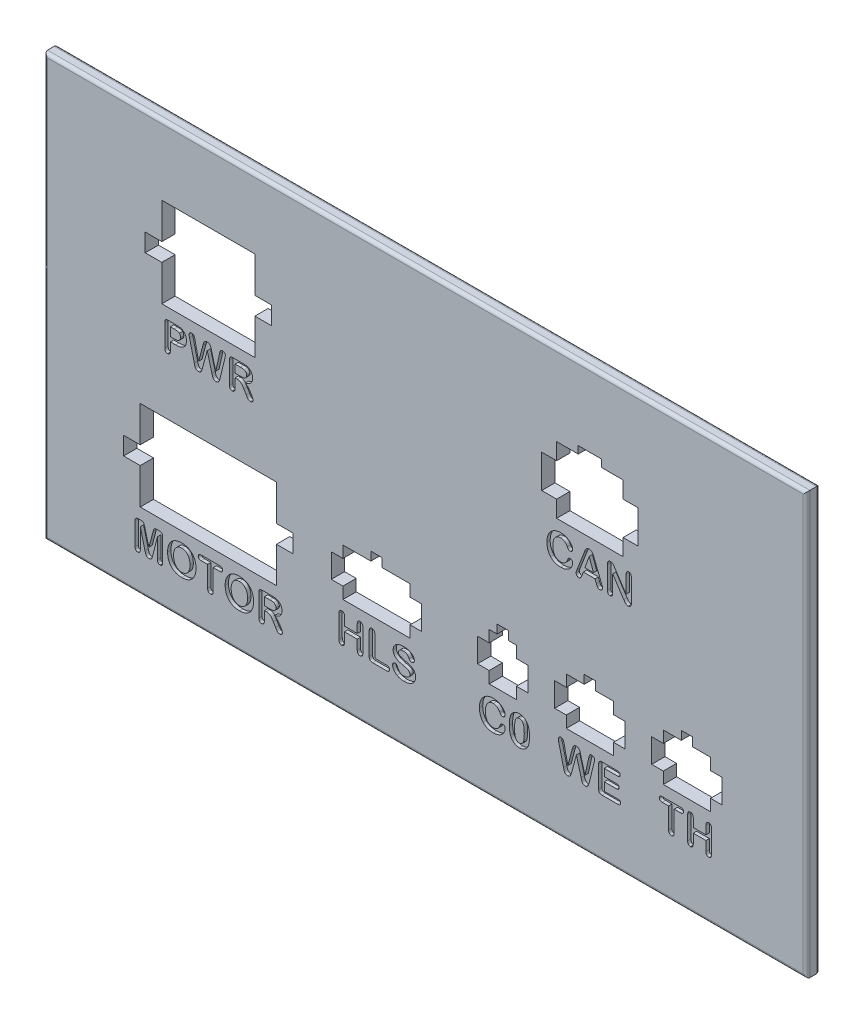
from build123d import *

# Parameters (mm, degrees)
SKETCH1_W           = 105.8
SKETCH1_H           = 53.6
BOSS_EXTRUDE1_DEPTH = 2
SKETCH2_W           = 4.1
SKETCH2_H           = 7.1
SKETCH2_W_2         = 20.5
SKETCH2_H_2         = 13.5
SKETCH2_W_3         = 10
SKETCH2_H_3         = 10
SKETCH2_W_4         = 7.1
SKETCH2_W_5         = 14
SKETCH2_W_6         = 10.1
CUT_EXTRUDE2_DEPTH  = 60.335065518
SKETCH4_W           = 2.5
SKETCH4_H           = 2.7
SKETCH4_W_2         = 1.75
SKETCH4_H_2         = 3.6
SKETCH4_W_3         = 1.7
SKETCH4_H_3         = 1.3
SKETCH4_W_4         = 10.6
SKETCH4_H_4         = 8.4
SKETCH4_W_5         = 3.5
SKETCH4_H_5         = 11.1
SKETCH4_W_6         = 14.5
SKETCH4_H_6         = 5
CUT_EXTRUDE5_DEPTH  = 10
BOSS_EXTRUDE2_DEPTH = 2
SKETCH6_W           = 115.8
SKETCH6_H           = 63.6
SKETCH6_W_2         = 114.7
SKETCH6_H_2         = 63.5
CUT_EXTRUDE6_DEPTH  = 69.634175161
FILLET1_R           = 0.5
CUT_EXTRUDE7_DEPTH  = 0.5


with BuildPart() as part:
    # Sketch1 → Boss-Extrude1 (new body)
    with BuildSketch(Plane.XY):
        Rectangle(SKETCH1_W, SKETCH1_H)
    extrude(amount=BOSS_EXTRUDE1_DEPTH)

    # Sketch2 → Cut-Extrude2 (cut, through all)
    with BuildSketch(Plane.XY):
        with Locations((11.65, -8.55)):
            Rectangle(SKETCH2_W, SKETCH2_H)
        with Locations((-32.65, -8.55)):
            Rectangle(SKETCH2_W_2, SKETCH2_H_2)
        with Locations((24.75, 19.55)):
            Rectangle(SKETCH2_W_3, SKETCH2_H_3)
        with Locations((39.35, -8.55)):
            Rectangle(SKETCH2_W_4, SKETCH2_H)
        with Locations((-32.65, 19.55)):
            Rectangle(SKETCH2_W_5, SKETCH2_H_2)
        with Locations((24.75, -8.55)):
            Rectangle(SKETCH2_W_4, SKETCH2_H)
        with Locations((-7.35, -8.55)):
            Rectangle(SKETCH2_W_6, SKETCH2_H)
    extrude(amount=CUT_EXTRUDE2_DEPTH, mode=Mode.SUBTRACT)

    # Sketch4 → Cut-Extrude5 (cut)
    with BuildSketch(Plane.XY.offset(2)):
        with Locations((-24.4, 19.55)):
            Rectangle(SKETCH4_W, SKETCH4_H)
        with Locations((-40.9, 19.55)):
            Rectangle(SKETCH4_W, SKETCH4_H)
        with Locations((-44.15, -8.55)):
            Rectangle(SKETCH4_W, SKETCH4_H)
        with Locations((-21.15, -8.55)):
            Rectangle(SKETCH4_W, SKETCH4_H)
        with Locations((-13.275, -8.55)):
            Rectangle(SKETCH4_W_2, SKETCH4_H_2)
        with Locations((-1.425, -8.55)):
            Rectangle(SKETCH4_W_2, SKETCH4_H_2)
        with Locations((-7.35, -4.35)):
            Rectangle(SKETCH4_W_3, SKETCH4_H_3)
        with Locations((11.65, -4.35)):
            Rectangle(SKETCH4_W_3, SKETCH4_H_3)
        with Locations((14.575, -8.55)):
            Rectangle(SKETCH4_W_2, SKETCH4_H_2)
        with Locations((8.725, -8.55)):
            Rectangle(SKETCH4_W_2, SKETCH4_H_2)
        with Locations((29.175, -8.55)):
            Rectangle(SKETCH4_W_2, SKETCH4_H_2)
        with Locations((20.325, -8.55)):
            Rectangle(SKETCH4_W_2, SKETCH4_H_2)
        with Locations((24.75, -4.35)):
            Rectangle(SKETCH4_W_3, SKETCH4_H_3)
        with Locations((39.35, -8.55)):
            Rectangle(SKETCH4_W_4, SKETCH4_H_2)
        with Locations((39.35, -7.9)):
            Rectangle(SKETCH4_W_3, SKETCH4_H_4)
        with Locations((24.75, 20.1)):
            Rectangle(SKETCH4_W_5, SKETCH4_H_5)
        with Locations((24.75, 19.55)):
            Rectangle(SKETCH4_W_6, SKETCH4_H_6)
    extrude(amount=-CUT_EXTRUDE5_DEPTH, mode=Mode.SUBTRACT)

    # Sketch5 → Boss-Extrude2 (add)
    with BuildSketch(Plane.XY):
        Polygon((-52.9, 26.8), (-52.9, -26.8), (-57.9, -26.8), (-57.9, 36.8), (57.9, 36.8), (57.9, -26.8), (52.9, -26.8), (52.9, 26.8), align=None)
    extrude(amount=BOSS_EXTRUDE2_DEPTH)

    # Sketch6 → Cut-Extrude6 (cut, through all)
    with BuildSketch(Plane.XY):
        with Locations((0, 5)):
            Rectangle(SKETCH6_W, SKETCH6_H)
        with Locations((0, 5)):
            Rectangle(SKETCH6_W_2, SKETCH6_H_2, mode=Mode.SUBTRACT)
    extrude(amount=CUT_EXTRUDE6_DEPTH, mode=Mode.SUBTRACT)

    # Fillet1
    fillet1_edges = [part.edges().sort_by_distance(p)[0] for p in [
        (57.35, 5, 0),
        (0, 36.75, 0),
        (-57.35, 5, 0),
        (0, -26.75, 0),
        (57.35, 5, 2),
        (0, 36.75, 2),
        (-57.35, 5, 2),
        (0, -26.75, 2),
    ]]
    fillet(fillet1_edges, radius=FILLET1_R)

    # Sketch7 → Cut-Extrude7 (cut)
    # profile 1 of 20: a face of its own
    with BuildSketch(Plane.XY.offset(2)):
        with BuildLine():
            Line((-37.56484375, 8.4875), (-38.359375, 8.4875))
            Line((-38.359375, 8.4875), (-38.359375, 7.273730469))
            add(Edge.make_bspline(
                [(-38.359375, 7.273730469), (-38.360387223, 7.232874012), (-38.362306321, 7.155413214), (-38.38544335, 7.04736213), (-38.421872819, 6.953670133), (-38.475351253, 6.877612166), (-38.539376687, 6.817694391), (-38.612002084, 6.774108495), (-38.693500457, 6.748855227), (-38.750315252, 6.7454822), (-38.779492187, 6.74375)],
                knots=[0, 0, 0, 0, 1.285699921, 2.437591255, 3.464765735, 4.43309728, 5.341309432, 6.21076238, 7.081146562, 8, 8, 8, 8], degree=3))
            add(Edge.make_bspline(
                [(-38.779492187, 6.74375), (-38.809824781, 6.745484564), (-38.868625573, 6.748847078), (-38.952671543, 6.773657324), (-39.026133925, 6.817544129), (-39.090763387, 6.876149077), (-39.142418677, 6.952507457), (-39.17785035, 7.045387542), (-39.199964524, 7.152872936), (-39.202032857, 7.229665848), (-39.203125, 7.270214844)],
                knots=[0, 0, 0, 0, 0.952842406, 1.847118322, 2.721986042, 3.621319613, 4.568808427, 5.589565879, 6.727217387, 8, 8, 8, 8], degree=3))
            Line((-39.203125, 7.270214844), (-39.203125, 10.595996094))
            add(Edge.make_bspline(
                [(-39.203125, 10.595996094), (-39.2028805, 10.61915474), (-39.202409106, 10.663804423), (-39.196190948, 10.728460915), (-39.185766115, 10.787791917), (-39.171803436, 10.842336508), (-39.153580223, 10.89128044), (-39.131289943, 10.935295249), (-39.105036762, 10.974310593), (-39.06302681, 11.019562809), (-38.997552479, 11.066938173), (-38.900968714, 11.104889959), (-38.786086085, 11.12739686), (-38.703435376, 11.129904376), (-38.659082031, 11.13125)],
                knots=[0, 0, 0, 0, 0.941718592, 1.815625801, 2.638480297, 3.389986758, 4.102699286, 4.758224476, 5.39283612, 6.008479495, 7.262224214, 8.640906231, 10.197389428, 12, 12, 12, 12], degree=3))
            Line((-38.659082031, 11.13125), (-37.556933594, 11.13125))
            add(Edge.make_bspline(
                [(-37.556933594, 11.13125), (-37.517376983, 11.131257568), (-37.440580049, 11.131272261), (-37.328951282, 11.126349689), (-37.224349227, 11.12025313), (-37.126633793, 11.112951451), (-37.036051418, 11.10143274), (-36.952595989, 11.087162197), (-36.875817272, 11.072030796), (-36.827664347, 11.058589433), (-36.804589844, 11.052148438)],
                knots=[0, 0, 0, 0, 1.25088383, 2.428520539, 3.533027188, 4.564878591, 5.52680176, 6.419426011, 7.242601342, 8, 8, 8, 8], degree=3))
            add(Edge.make_bspline(
                [(-36.804589844, 11.052148438), (-36.76084496, 11.038831907), (-36.674788853, 11.012635273), (-36.553839415, 10.955913754), (-36.440828301, 10.889253227), (-36.338326339, 10.808925937), (-36.24588238, 10.718553937), (-36.164904418, 10.618049831), (-36.096022401, 10.507735279), (-36.04030565, 10.387550084), (-35.994776102, 10.259756632), (-35.963820773, 10.123444458), (-35.943674634, 9.979607484), (-35.941656859, 9.880930577), (-35.940625, 9.83046875)],
                knots=[0, 0, 0, 0, 1.016072159, 1.998844374, 2.963446839, 3.929479405, 4.88809646, 5.833686282, 6.79396355, 7.773575509, 8.775354313, 9.806098629, 10.878073131, 12, 12, 12, 12], degree=3))
            add(Edge.make_bspline(
                [(-35.940625, 9.83046875), (-35.941645042, 9.777081055), (-35.943630661, 9.673156328), (-35.963672, 9.522279867), (-35.994530602, 9.380980201), (-36.039640968, 9.249722719), (-36.097711537, 9.12872901), (-36.168697785, 9.017875441), (-36.251933717, 8.916684356), (-36.348284762, 8.825867153), (-36.457297321, 8.745607844), (-36.578526396, 8.675488974), (-36.713251697, 8.618300613), (-36.859419592, 8.569406351), (-37.018562171, 8.533486157), (-37.189327972, 8.505931944), (-37.372952756, 8.49035739), (-37.499483173, 8.488473264), (-37.56484375, 8.4875)],
                knots=[0, 0, 0, 0, 1.064269092, 2.071710987, 3.030014155, 3.944730477, 4.833317459, 5.700512996, 6.563900655, 7.440202656, 8.334248487, 9.258341999, 10.226640684, 11.248485432, 12.328534365, 13.476518405, 14.696469853, 16, 16, 16, 16], degree=3))
        make_face()
        with BuildLine():
            Line((-37.774902344, 10.45625), (-38.359375, 10.45625))
            Line((-38.359375, 10.45625), (-38.359375, 9.1625))
            Line((-38.359375, 9.1625), (-37.774902344, 9.1625))
            add(Edge.make_bspline(
                [(-37.774902344, 9.1625), (-37.72596041, 9.16345721), (-37.632038049, 9.16529415), (-37.49710106, 9.176011296), (-37.374977314, 9.196442182), (-37.264716874, 9.222780465), (-37.166738258, 9.25939774), (-37.081368192, 9.307490262), (-37.00729572, 9.364506048), (-36.946446402, 9.432810994), (-36.897544278, 9.511473231), (-36.865151901, 9.602305322), (-36.844209234, 9.703542747), (-36.841858301, 9.774688566), (-36.840625, 9.812011719)],
                knots=[0, 0, 0, 0, 1.355309994, 2.600917123, 3.743816141, 4.780660951, 5.735811607, 6.62931006, 7.484500426, 8.311764707, 9.149305958, 10.032284453, 10.967734859, 12, 12, 12, 12], degree=3))
            add(Edge.make_bspline(
                [(-36.840625, 9.812011719), (-36.842517381, 9.856758271), (-36.846164716, 9.943001814), (-36.877992743, 10.065767146), (-36.929071612, 10.176932211), (-36.980912999, 10.237828163), (-37.006738281, 10.268164063)],
                knots=[0, 0, 0, 0, 1.078100798, 2.07790835, 3.042491687, 4, 4, 4, 4], degree=3))
            add(Edge.make_bspline(
                [(-37.006738281, 10.268164063), (-37.023874714, 10.283387777), (-37.059900765, 10.315392708), (-37.126271982, 10.354023398), (-37.205362187, 10.384327779), (-37.295214026, 10.412414331), (-37.397934249, 10.431413504), (-37.512602167, 10.446533607), (-37.639716715, 10.455043513), (-37.728601703, 10.455836782), (-37.774902344, 10.45625)],
                knots=[0, 0, 0, 0, 0.67948794, 1.428492636, 2.263733299, 3.191206897, 4.220047442, 5.360670486, 6.625159889, 8, 8, 8, 8], degree=3))
        make_face(mode=Mode.SUBTRACT)
    # profile 2 of 20: a face of its own
    with BuildSketch(Plane.XY.offset(2)):
        with BuildLine():
            Line((-32.114746094, 7.504882813), (-32.814355469, 10.11875))
            Line((-32.814355469, 10.11875), (-33.522753906, 7.504882813))
            add(Edge.make_bspline(
                [(-33.522753906, 7.504882813), (-33.535974802, 7.458900036), (-33.560415379, 7.373894784), (-33.593696157, 7.256114093), (-33.626088561, 7.160223901), (-33.652123516, 7.08056526), (-33.681973875, 7.013419296), (-33.721215487, 6.953887731), (-33.767405666, 6.896375101), (-33.823598866, 6.844034655), (-33.888559807, 6.797563927), (-33.965967729, 6.766622362), (-34.052295969, 6.746569194), (-34.11325434, 6.744715798), (-34.145019531, 6.74375)],
                knots=[0, 0, 0, 0, 1.593450199, 2.945703666, 4.074932583, 4.963578588, 5.736316224, 6.513047046, 7.331315113, 8.187222847, 9.064061049, 9.973669067, 10.944086134, 12, 12, 12, 12], degree=3))
            add(Edge.make_bspline(
                [(-34.145019531, 6.74375), (-34.170845143, 6.744300242), (-34.22043201, 6.745356744), (-34.291381496, 6.756818971), (-34.355232289, 6.776121038), (-34.412406136, 6.802723786), (-34.463305291, 6.836619047), (-34.507969443, 6.877441372), (-34.54839854, 6.9238548), (-34.59590367, 6.996368124), (-34.645297735, 7.102296264), (-34.690106152, 7.241582199), (-34.725463008, 7.3848246), (-34.750189342, 7.479129057), (-34.762011719, 7.52421875)],
                knots=[0, 0, 0, 0, 0.844984364, 1.622425369, 2.344584211, 3.02258317, 3.679700754, 4.338496446, 4.99812959, 5.68983231, 7.169954297, 8.807945526, 10.473786272, 12, 12, 12, 12], degree=3))
            Line((-34.762011719, 7.52421875), (-35.481835937, 10.454492188))
            add(Edge.make_bspline(
                [(-35.481835937, 10.454492188), (-35.49158828, 10.494255402), (-35.509869353, 10.568792801), (-35.529741372, 10.67352958), (-35.54352275, 10.763222428), (-35.545826611, 10.818028744), (-35.546875, 10.84296875)],
                knots=[0, 0, 0, 0, 1.244637899, 2.333112935, 3.241471125, 4, 4, 4, 4], degree=3))
            add(Edge.make_bspline(
                [(-35.546875, 10.84296875), (-35.545804341, 10.870418808), (-35.543714132, 10.924008556), (-35.519098495, 10.999803574), (-35.483082615, 11.069796512), (-35.430257262, 11.129318414), (-35.368887699, 11.181064847), (-35.297077212, 11.216931793), (-35.219032861, 11.24033315), (-35.164433033, 11.242591545), (-35.136425781, 11.24375)],
                knots=[0, 0, 0, 0, 1.026200576, 2.003414008, 2.96246285, 3.960541354, 4.968440915, 5.956723063, 6.951891004, 8, 8, 8, 8], degree=3))
            add(Edge.make_bspline(
                [(-35.136425781, 11.24375), (-35.117368487, 11.243181946), (-35.080583039, 11.242085455), (-35.027690577, 11.235484121), (-34.97981856, 11.222747639), (-34.936338301, 11.206912953), (-34.898824816, 11.183761713), (-34.864850954, 11.157824313), (-34.836513558, 11.125716104), (-34.805116526, 11.074360364), (-34.770984037, 10.998848945), (-34.735021063, 10.894614869), (-34.699142835, 10.773747167), (-34.680511802, 10.68639014), (-34.670605469, 10.639941406)],
                knots=[0, 0, 0, 0, 0.808122328, 1.559882671, 2.252704358, 2.905404214, 3.512433654, 4.113718811, 4.711917797, 5.314868035, 6.65938252, 8.214937873, 9.987439056, 12, 12, 12, 12], degree=3))
            Line((-34.670605469, 10.639941406), (-34.103710937, 8.09375))
            Line((-34.103710937, 8.09375), (-33.469140625, 10.476464844))
            add(Edge.make_bspline(
                [(-33.469140625, 10.476464844), (-33.457884926, 10.519283965), (-33.436705181, 10.599856315), (-33.404464579, 10.712185978), (-33.373793126, 10.808069633), (-33.34460805, 10.890252024), (-33.311767302, 10.962395647), (-33.269948239, 11.027124994), (-33.218963476, 11.086308464), (-33.160484179, 11.141494576), (-33.090575364, 11.188315049), (-33.008038332, 11.220085896), (-32.91503231, 11.24131468), (-32.849058844, 11.242910544), (-32.814355469, 11.24375)],
                knots=[0, 0, 0, 0, 1.431879488, 2.694354579, 3.779085509, 4.687368261, 5.51393756, 6.336587382, 7.17007913, 8.035022418, 8.931165, 9.870736774, 10.879964543, 12, 12, 12, 12], degree=3))
            add(Edge.make_bspline(
                [(-32.814355469, 11.24375), (-32.779391636, 11.242458402), (-32.712917028, 11.240002766), (-32.619250167, 11.220139862), (-32.537875034, 11.185500526), (-32.470144446, 11.136978012), (-32.413520962, 11.081735709), (-32.366799204, 11.023076189), (-32.327611298, 10.963019081), (-32.299070139, 10.895891166), (-32.273170654, 10.817796093), (-32.243314581, 10.722839327), (-32.209008741, 10.606896541), (-32.186042844, 10.522220856), (-32.173632812, 10.476464844)],
                knots=[0, 0, 0, 0, 1.14054899, 2.168456379, 3.106445743, 4.005812281, 4.871449232, 5.680910185, 6.450289684, 7.203755686, 8.053559891, 9.136318933, 10.452559013, 12, 12, 12, 12], degree=3))
            Line((-32.173632812, 10.476464844), (-31.533789062, 8.09375))
            Line((-31.533789062, 8.09375), (-30.966894531, 10.639941406))
            add(Edge.make_bspline(
                [(-30.966894531, 10.639941406), (-30.960341583, 10.67133026), (-30.947936193, 10.730752522), (-30.927571159, 10.814174943), (-30.908347468, 10.886872296), (-30.890091347, 10.950774566), (-30.867900866, 11.007659242), (-30.839398177, 11.060294265), (-30.803971143, 11.109327406), (-30.762806315, 11.155787913), (-30.7126751, 11.196652566), (-30.650318834, 11.224432197), (-30.578735955, 11.241387984), (-30.527839204, 11.242935966), (-30.501074219, 11.24375)],
                knots=[0, 0, 0, 0, 1.365133971, 2.584336173, 3.655375053, 4.566954256, 5.412386126, 6.249588628, 7.10798716, 7.982279155, 8.888122676, 9.836835566, 10.862460541, 12, 12, 12, 12], degree=3))
            add(Edge.make_bspline(
                [(-30.501074219, 11.24375), (-30.4733942, 11.242483953), (-30.419516971, 11.24001968), (-30.341903445, 11.218174822), (-30.271332129, 11.181262643), (-30.208695553, 11.131259457), (-30.155491453, 11.071511597), (-30.11802325, 11.00158648), (-30.093876488, 10.924823336), (-30.091726323, 10.870694002), (-30.090625, 10.84296875)],
                knots=[0, 0, 0, 0, 1.03699291, 2.018434435, 2.996793341, 4.006213175, 5.011314616, 5.975429195, 6.96300709, 8, 8, 8, 8], degree=3))
            add(Edge.make_bspline(
                [(-30.090625, 10.84296875), (-30.091808923, 10.819802032), (-30.094501077, 10.767122647), (-30.106382322, 10.678921085), (-30.128566817, 10.572855273), (-30.146147778, 10.496060132), (-30.155664062, 10.454492188)],
                knots=[0, 0, 0, 0, 0.70532364, 1.603853198, 2.703005224, 4, 4, 4, 4], degree=3))
            Line((-30.155664062, 10.454492188), (-30.875488281, 7.52421875))
            add(Edge.make_bspline(
                [(-30.875488281, 7.52421875), (-30.887005563, 7.478169375), (-30.908473581, 7.392334126), (-30.941228569, 7.273811366), (-30.96966332, 7.174492926), (-30.996454082, 7.092309926), (-31.024933035, 7.021504905), (-31.062794141, 6.958591191), (-31.108414133, 6.899451352), (-31.16312895, 6.845639907), (-31.227135027, 6.798130326), (-31.305836316, 6.767211754), (-31.394985895, 6.746229917), (-31.458941894, 6.744603103), (-31.492480469, 6.74375)],
                knots=[0, 0, 0, 0, 1.552883699, 2.894548732, 4.02287014, 4.932163049, 5.722544985, 6.513217449, 7.326118303, 8.159774563, 9.018830479, 9.912428932, 10.905276121, 12, 12, 12, 12], degree=3))
            add(Edge.make_bspline(
                [(-31.492480469, 6.74375), (-31.524237519, 6.744727371), (-31.585180268, 6.746602977), (-31.671616185, 6.766503066), (-31.748723792, 6.798004621), (-31.814710261, 6.84243492), (-31.869677219, 6.894954989), (-31.91683143, 6.950485976), (-31.955165447, 7.009389177), (-31.984491847, 7.075681849), (-32.010943326, 7.154135858), (-32.041907465, 7.251072539), (-32.0764817, 7.370587941), (-32.101304054, 7.457705871), (-32.114746094, 7.504882813)],
                knots=[0, 0, 0, 0, 1.054963199, 2.024506573, 2.933295648, 3.811943645, 4.653302703, 5.455819296, 6.231850806, 6.982109028, 7.860757024, 8.985975481, 10.367816402, 12, 12, 12, 12], degree=3))
        make_face()
    # profile 3 of 20: a face of its own
    with BuildSketch(Plane.XY.offset(2)):
        with BuildLine():
            Line((-28.324023437, 8.65625), (-28.628125, 8.65625))
            Line((-28.628125, 8.65625), (-28.628125, 7.274609375))
            add(Edge.make_bspline(
                [(-28.628125, 7.274609375), (-28.629195667, 7.232020652), (-28.631198944, 7.152334809), (-28.652918959, 7.041361967), (-28.689471347, 6.947767616), (-28.741122986, 6.872050535), (-28.805132107, 6.814687982), (-28.878158561, 6.773157092), (-28.960462776, 6.747732164), (-29.018470165, 6.745100625), (-29.048242187, 6.74375)],
                knots=[0, 0, 0, 0, 1.331902197, 2.492062242, 3.520752585, 4.456973203, 5.333663409, 6.188000262, 7.069999586, 8, 8, 8, 8], degree=3))
            add(Edge.make_bspline(
                [(-29.048242187, 6.74375), (-29.080060431, 6.745364704), (-29.141298015, 6.748472374), (-29.22753713, 6.774258315), (-29.302016069, 6.817911147), (-29.364909071, 6.877986197), (-29.413713948, 6.955634967), (-29.447327148, 7.049155529), (-29.468569759, 7.157649597), (-29.470730004, 7.235241247), (-29.471875, 7.276367188)],
                knots=[0, 0, 0, 0, 0.98783513, 1.901193439, 2.76656523, 3.649069121, 4.578809423, 5.590416226, 6.722847106, 8, 8, 8, 8], degree=3))
            Line((-29.471875, 7.276367188), (-29.471875, 10.595996094))
            add(Edge.make_bspline(
                [(-29.471875, 10.595996094), (-29.470586925, 10.639775587), (-29.468170025, 10.72192198), (-29.444736008, 10.835569245), (-29.406631268, 10.931002205), (-29.350275252, 11.007772656), (-29.274421244, 11.065070648), (-29.18020025, 11.1041987), (-29.067531973, 11.127569977), (-28.986257357, 11.129967348), (-28.942773437, 11.13125)],
                knots=[0, 0, 0, 0, 1.204539147, 2.260157444, 3.178834964, 4.014831347, 4.849268471, 5.763683293, 6.803515522, 8, 8, 8, 8], degree=3))
            Line((-28.942773437, 11.13125), (-27.540039062, 11.13125))
            add(Edge.make_bspline(
                [(-27.540039062, 11.13125), (-27.493456165, 11.130823225), (-27.403784564, 11.130001687), (-27.274177983, 11.126256526), (-27.155214174, 11.11711247), (-27.045500485, 11.105925103), (-26.943593964, 11.09093788), (-26.848059353, 11.06732304), (-26.757037037, 11.039263847), (-26.699877918, 11.01375575), (-26.671679687, 11.001171875)],
                knots=[0, 0, 0, 0, 1.26312999, 2.431512321, 3.514756431, 4.497259456, 5.421894158, 6.30431173, 7.16346842, 8, 8, 8, 8], degree=3))
            add(Edge.make_bspline(
                [(-26.671679687, 11.001171875), (-26.637938121, 10.986025911), (-26.570846371, 10.955909667), (-26.476215584, 10.898678122), (-26.387348858, 10.833051636), (-26.305694374, 10.75778147), (-26.230619456, 10.676006528), (-26.166635516, 10.585310122), (-26.110759822, 10.489372414), (-26.065092552, 10.387038452), (-26.029514776, 10.280059653), (-26.002422924, 10.169681781), (-25.987676704, 10.055871015), (-25.985481208, 9.979042378), (-25.984375, 9.940332031)],
                knots=[0, 0, 0, 0, 0.991101386, 1.970706541, 2.959125982, 3.949043219, 4.94477413, 5.930285116, 6.919453739, 7.918248778, 8.929482208, 9.939493973, 10.961807665, 12, 12, 12, 12], degree=3))
            add(Edge.make_bspline(
                [(-25.984375, 9.940332031), (-25.985157461, 9.901032893), (-25.986686144, 9.824254745), (-26.000392663, 9.712305592), (-26.021266833, 9.606095384), (-26.050538783, 9.505588473), (-26.091051523, 9.411902695), (-26.138054279, 9.323824887), (-26.194212069, 9.241789534), (-26.259413537, 9.166105285), (-26.333883789, 9.096664369), (-26.416464692, 9.03192345), (-26.507721372, 8.972168323), (-26.608617264, 8.918792681), (-26.718093264, 8.870120624), (-26.836829445, 8.827989151), (-26.963717447, 8.788215826), (-27.052367903, 8.76839459), (-27.097949219, 8.758203125)],
                knots=[0, 0, 0, 0, 1.055142993, 2.061417327, 3.024364171, 3.960444909, 4.866579139, 5.760848635, 6.638237999, 7.530982974, 8.438346324, 9.368654669, 10.346405169, 11.363786046, 12.431180916, 13.561267985, 14.746079633, 16, 16, 16, 16], degree=3))
            add(Edge.make_bspline(
                [(-27.097949219, 8.758203125), (-27.05843296, 8.736217104), (-26.977857271, 8.691386472), (-26.864465862, 8.605799241), (-26.752417156, 8.507731691), (-26.646091746, 8.394089826), (-26.542784436, 8.272926798), (-26.443006993, 8.147347826), (-26.349951852, 8.017258745), (-26.26418889, 7.884666607), (-26.184852939, 7.754349569), (-26.114253538, 7.628701464), (-26.053729084, 7.509132468), (-26.002298446, 7.398087387), (-25.961331092, 7.298978603), (-25.932144138, 7.215094919), (-25.912535155, 7.148595831), (-25.908653619, 7.109159157), (-25.90703125, 7.092675781)],
                knots=[0, 0, 0, 0, 1.03513849, 2.110700756, 3.247524223, 4.444168505, 5.672631725, 6.896242247, 8.11841533, 9.33624741, 10.514118669, 11.614189172, 12.638032039, 13.584270828, 14.418327787, 15.09350525, 15.621111712, 16, 16, 16, 16], degree=3))
            add(Edge.make_bspline(
                [(-25.90703125, 7.092675781), (-25.910031029, 7.064108894), (-25.91632536, 7.004167986), (-25.952806408, 6.935120754), (-25.991404097, 6.883889772), (-26.026079918, 6.847795866), (-26.066842128, 6.817485295), (-26.111741628, 6.79084548), (-26.161035568, 6.769664345), (-26.214589396, 6.755020872), (-26.271673391, 6.744682863), (-26.311279254, 6.744065741), (-26.331542969, 6.74375)],
                knots=[0, 0, 0, 0, 1.406975553, 2.952207972, 3.767564478, 4.575194754, 5.410805362, 6.266190622, 7.146975177, 8.048514508, 9.001553276, 10, 10, 10, 10], degree=3))
            add(Edge.make_bspline(
                [(-26.331542969, 6.74375), (-26.355352117, 6.744490091), (-26.401313039, 6.745918756), (-26.467145571, 6.759836664), (-26.527757069, 6.780301015), (-26.599575739, 6.821389419), (-26.678756697, 6.888633272), (-26.745847078, 6.971571776), (-26.797591764, 7.049961154), (-26.84268798, 7.122026284), (-26.896113187, 7.2054971), (-26.932576478, 7.266017257), (-26.952050781, 7.298339844)],
                knots=[0, 0, 0, 0, 0.811939239, 1.567358733, 2.288822191, 2.987519458, 4.379962622, 5.808282274, 6.615771143, 7.58722562, 8.711386222, 10, 10, 10, 10], degree=3))
            Line((-26.952050781, 7.298339844), (-27.305371094, 7.879296875))
            add(Edge.make_bspline(
                [(-27.305371094, 7.879296875), (-27.335495634, 7.929605171), (-27.392463042, 8.024741336), (-27.478351782, 8.156244864), (-27.560151868, 8.268123382), (-27.637037925, 8.362864634), (-27.71175086, 8.441892545), (-27.786294309, 8.506955473), (-27.862621276, 8.55730986), (-27.940227759, 8.596851995), (-28.023616454, 8.624193012), (-28.114967846, 8.643313519), (-28.216218807, 8.654634747), (-28.28707936, 8.655696461), (-28.324023437, 8.65625)],
                knots=[0, 0, 0, 0, 1.54923933, 2.929709427, 4.148172657, 5.209662816, 6.151357592, 7.018659628, 7.817301611, 8.561575462, 9.313059885, 10.128334294, 11.024182546, 12, 12, 12, 12], degree=3))
        make_face()
        with BuildLine():
            Line((-27.8265625, 10.45625), (-28.628125, 10.45625))
            Line((-28.628125, 10.45625), (-28.628125, 9.275))
            Line((-28.628125, 9.275), (-27.850292969, 9.275))
            add(Edge.make_bspline(
                [(-27.850292969, 9.275), (-27.800181411, 9.27571825), (-27.703668563, 9.277101572), (-27.565405209, 9.286329694), (-27.439401204, 9.302916164), (-27.326068366, 9.326095612), (-27.224110427, 9.356802169), (-27.135970757, 9.399720667), (-27.05837695, 9.44938908), (-26.994910519, 9.511292843), (-26.943883461, 9.584185672), (-26.909330475, 9.670131334), (-26.887805375, 9.767597063), (-26.885555652, 9.836497431), (-26.884375, 9.87265625)],
                knots=[0, 0, 0, 0, 1.392051732, 2.681035748, 3.846991481, 4.919597892, 5.892539963, 6.795281946, 7.634960986, 8.440706374, 9.24212453, 10.088520951, 10.996858383, 12, 12, 12, 12], degree=3))
            add(Edge.make_bspline(
                [(-26.884375, 9.87265625), (-26.885178494, 9.901763209), (-26.886752628, 9.958786978), (-26.90524767, 10.040992886), (-26.933489809, 10.118127509), (-26.973239235, 10.189030937), (-27.022352941, 10.253945939), (-27.082055308, 10.309173545), (-27.149614713, 10.357283365), (-27.200326641, 10.380310015), (-27.226269531, 10.392089844)],
                knots=[0, 0, 0, 0, 1.054557985, 2.06599635, 3.041648879, 4.026871944, 5.005128146, 5.982979788, 6.968145478, 8, 8, 8, 8], degree=3))
            add(Edge.make_bspline(
                [(-27.226269531, 10.392089844), (-27.240547923, 10.397308674), (-27.271585615, 10.408653119), (-27.323956174, 10.421636479), (-27.385514634, 10.431325745), (-27.455732623, 10.441479399), (-27.535247394, 10.44827342), (-27.624101627, 10.451978009), (-27.722229872, 10.456146198), (-27.790814852, 10.456214434), (-27.8265625, 10.45625)],
                knots=[0, 0, 0, 0, 0.601274756, 1.307022564, 2.130372336, 3.066540635, 4.11402688, 5.286356465, 6.585603249, 8, 8, 8, 8], degree=3))
        make_face(mode=Mode.SUBTRACT)
    # profile 4 of 20: a face of its own
    with BuildSketch(Plane.XY.offset(2)):
        with BuildLine():
            Line((-42.187011719, -20.629394531), (-42.8875, -17.86875))
            Line((-42.8875, -17.86875), (-42.8875, -20.859667969))
            add(Edge.make_bspline(
                [(-42.8875, -20.859667969), (-42.888677053, -20.898750099), (-42.890881481, -20.971944528), (-42.9114622, -21.074215715), (-42.943540361, -21.162107755), (-42.992473397, -21.233366051), (-43.051941278, -21.288527449), (-43.120796204, -21.328743565), (-43.199233193, -21.351903633), (-43.254436264, -21.354767661), (-43.283007812, -21.35625)],
                knots=[0, 0, 0, 0, 1.30362474, 2.441475632, 3.469867302, 4.406120522, 5.299256138, 6.158467928, 7.046875082, 8, 8, 8, 8], degree=3))
            add(Edge.make_bspline(
                [(-43.283007812, -21.35625), (-43.310720461, -21.354784951), (-43.364519241, -21.351940841), (-43.441047064, -21.328185003), (-43.509604063, -21.289535574), (-43.56949948, -21.235109518), (-43.617362971, -21.164030046), (-43.651866664, -21.077280994), (-43.671342856, -20.974779008), (-43.673730244, -20.901355634), (-43.675, -20.862304688)],
                knots=[0, 0, 0, 0, 0.931401934, 1.808137819, 2.66942439, 3.563139973, 4.50699297, 5.529036112, 6.685793447, 8, 8, 8, 8], degree=3))
            Line((-43.675, -20.862304688), (-43.675, -17.448632813))
            add(Edge.make_bspline(
                [(-43.675, -17.448632813), (-43.674358722, -17.426065174), (-43.673123718, -17.382603375), (-43.667537693, -17.320160443), (-43.65616667, -17.263239839), (-43.639632031, -17.212602802), (-43.618954128, -17.167505846), (-43.5947741, -17.127470653), (-43.56451569, -17.093687541), (-43.517175397, -17.056785589), (-43.448064455, -17.020913209), (-43.354291049, -16.990136332), (-43.247966911, -16.971858496), (-43.17292571, -16.969818985), (-43.13359375, -16.96875)],
                knots=[0, 0, 0, 0, 0.969665939, 1.867427353, 2.689218696, 3.457225703, 4.149776576, 4.816702983, 5.458338976, 6.085245707, 7.385799533, 8.77853966, 10.311509556, 12, 12, 12, 12], degree=3))
            Line((-43.13359375, -16.96875), (-42.863769531, -16.96875))
            add(Edge.make_bspline(
                [(-42.863769531, -16.96875), (-42.825968498, -16.969217103), (-42.755835059, -16.970083733), (-42.65903761, -16.977157639), (-42.578977222, -16.991040034), (-42.513289427, -17.009659295), (-42.459545925, -17.037528036), (-42.413974941, -17.072800011), (-42.37642514, -17.118020091), (-42.34594732, -17.173574036), (-42.318752246, -17.242185836), (-42.290369603, -17.326645559), (-42.25837217, -17.428375944), (-42.23882153, -17.502735239), (-42.228320312, -17.542675781)],
                knots=[0, 0, 0, 0, 1.38803647, 2.575267475, 3.558583177, 4.368440808, 5.070869684, 5.768090105, 6.470518981, 7.212366556, 8.085347214, 9.177334938, 10.483864409, 12, 12, 12, 12], degree=3))
            Line((-42.228320312, -17.542675781), (-41.59375, -19.89375))
            Line((-41.59375, -19.89375), (-40.967089844, -17.542675781))
            add(Edge.make_bspline(
                [(-40.967089844, -17.542675781), (-40.956584606, -17.502737561), (-40.937026483, -17.428382589), (-40.905076642, -17.326624715), (-40.876555893, -17.242244756), (-40.849689716, -17.17327597), (-40.817971267, -17.118266046), (-40.780616485, -17.072762402), (-40.734965498, -17.037550364), (-40.681012589, -17.009473322), (-40.614639948, -16.991101163), (-40.533736923, -16.977150412), (-40.436348674, -16.97011217), (-40.365925061, -16.969225775), (-40.328125, -16.96875)],
                knots=[0, 0, 0, 0, 1.511478991, 2.813995637, 3.902629473, 4.772928891, 5.517843496, 6.218114959, 6.913193965, 7.613465427, 8.431097637, 9.421953472, 10.616226692, 12, 12, 12, 12], degree=3))
            Line((-40.328125, -16.96875), (-40.057421875, -16.96875))
            add(Edge.make_bspline(
                [(-40.057421875, -16.96875), (-40.017801182, -16.969829481), (-39.942186106, -16.971889642), (-39.835223236, -16.990000013), (-39.741237034, -17.020958054), (-39.67196727, -17.056685777), (-39.624780678, -17.093976299), (-39.593449303, -17.127107205), (-39.569742998, -17.167800716), (-39.547309884, -17.212155281), (-39.532866366, -17.263590537), (-39.519507773, -17.319984947), (-39.514506466, -17.382635981), (-39.513185773, -17.426076318), (-39.5125, -17.448632813)],
                knots=[0, 0, 0, 0, 1.69575107, 3.236297379, 4.624693315, 5.921190494, 6.546141798, 7.194208304, 7.859054455, 8.55478081, 9.316580419, 10.138397467, 11.033358612, 12, 12, 12, 12], degree=3))
            Line((-39.5125, -17.448632813), (-39.5125, -20.862304688))
            add(Edge.make_bspline(
                [(-39.5125, -20.862304688), (-39.51371058, -20.901085141), (-39.515985775, -20.973970077), (-39.536255728, -21.075772615), (-39.568824742, -21.163135207), (-39.617180207, -21.234250109), (-39.677385647, -21.288752222), (-39.746706002, -21.328758644), (-39.826010049, -21.351898076), (-39.881782767, -21.354765922), (-39.910644531, -21.35625)],
                knots=[0, 0, 0, 0, 1.293518314, 2.431070022, 3.450077594, 4.386084638, 5.272371044, 6.139835868, 7.037385671, 8, 8, 8, 8], degree=3))
            add(Edge.make_bspline(
                [(-39.910644531, -21.35625), (-39.938054975, -21.354765195), (-39.991261566, -21.351883032), (-40.067229021, -21.328355461), (-40.134792116, -21.288271009), (-40.194226837, -21.233412665), (-40.242882252, -21.161911347), (-40.276323599, -21.074443566), (-40.296525016, -20.971907249), (-40.2987904, -20.898737122), (-40.3, -20.859667969)],
                knots=[0, 0, 0, 0, 0.922456205, 1.790585791, 2.649061979, 3.550299627, 4.495046019, 5.536376652, 6.684549498, 8, 8, 8, 8], degree=3))
            Line((-40.3, -20.859667969), (-40.3, -17.86875))
            Line((-40.3, -17.86875), (-41.000488281, -20.629394531))
            add(Edge.make_bspline(
                [(-41.000488281, -20.629394531), (-41.011152541, -20.671334696), (-41.030960573, -20.749235287), (-41.060966236, -20.856668849), (-41.087601766, -20.946224381), (-41.109844366, -21.021743885), (-41.137365393, -21.086699638), (-41.172609325, -21.146272505), (-41.218832498, -21.201525467), (-41.270923717, -21.255514364), (-41.335083426, -21.301431145), (-41.41142053, -21.333953285), (-41.499032963, -21.353416742), (-41.561123405, -21.355274045), (-41.59375, -21.35625)],
                knots=[0, 0, 0, 0, 1.501096557, 2.788170037, 3.868651286, 4.742863802, 5.516817816, 6.309819568, 7.133547599, 8.010237478, 8.906902995, 9.849006967, 10.869720086, 12, 12, 12, 12], degree=3))
            add(Edge.make_bspline(
                [(-41.59375, -21.35625), (-41.618709311, -21.355411002), (-41.666898312, -21.353791148), (-41.736038213, -21.341259832), (-41.799628091, -21.321218202), (-41.856857812, -21.291894517), (-41.907720434, -21.255941638), (-41.952040045, -21.21442635), (-41.992176487, -21.170262367), (-42.035446255, -21.1027477), (-42.079546624, -21.009966738), (-42.118626284, -20.888930236), (-42.150871047, -20.760462322), (-42.174825991, -20.673587301), (-42.187011719, -20.629394531)],
                knots=[0, 0, 0, 0, 0.868933015, 1.67765103, 2.439282522, 3.183205666, 3.908055228, 4.601401517, 5.295498424, 5.980457608, 7.386244959, 8.861049734, 10.403235965, 12, 12, 12, 12], degree=3))
        make_face()
    # profile 5 of 20: a face of its own
    with BuildSketch(Plane.XY.offset(2)):
        with BuildLine():
            add(Edge.make_bspline(
                [(-36.658691406, -16.85625), (-36.602997113, -16.857031838), (-36.493791189, -16.858564874), (-36.333050217, -16.87246143), (-36.178023228, -16.893088169), (-36.028815178, -16.922778065), (-35.885796214, -16.96151907), (-35.748939101, -17.009132438), (-35.618067485, -17.065460461), (-35.493028308, -17.129398005), (-35.375195131, -17.201775092), (-35.26381772, -17.280923181), (-35.160157623, -17.368003418), (-35.063973205, -17.462251417), (-34.975878139, -17.563924334), (-34.894591706, -17.67245764), (-34.82074007, -17.788461854), (-34.755118634, -17.911912326), (-34.696162209, -18.040964459), (-34.644984087, -18.175996487), (-34.602268798, -18.31643634), (-34.566738891, -18.462516653), (-34.539810816, -18.614023624), (-34.520843103, -18.771312081), (-34.507711699, -18.933761631), (-34.506741965, -19.044113805), (-34.50625, -19.100097656)],
                knots=[0, 0, 0, 0, 1.137132438, 2.22970057, 3.292424762, 4.329649132, 5.333981859, 6.315987487, 7.286185149, 8.241436353, 9.181332131, 10.107725602, 11.0292572, 11.943085262, 12.854854597, 13.773819033, 14.709898734, 15.660115542, 16.626635295, 17.605574315, 18.606712189, 19.622473761, 20.67399022, 21.747038223, 22.857027702, 24, 24, 24, 24], degree=3))
            add(Edge.make_bspline(
                [(-34.50625, -19.100097656), (-34.507966878, -19.182191225), (-34.511335592, -19.343268399), (-34.536888383, -19.579082461), (-34.580205379, -19.803556994), (-34.639199908, -20.016600943), (-34.716740453, -20.216739387), (-34.811076912, -20.403709494), (-34.923137375, -20.576608781), (-35.051714559, -20.735280948), (-35.196316819, -20.87882718), (-35.357932063, -21.003966443), (-35.535558073, -21.110773057), (-35.727617027, -21.200738395), (-35.935259268, -21.271620665), (-36.158064365, -21.319275171), (-36.394656159, -21.351709392), (-36.557501335, -21.354709573), (-36.641113281, -21.35625)],
                knots=[0, 0, 0, 0, 1.119700056, 2.196982321, 3.230778928, 4.235358115, 5.208318876, 6.153781848, 7.087131445, 8.013361148, 8.934611457, 9.860297843, 10.794468433, 11.756326826, 12.748403726, 13.780058436, 14.860183413, 16, 16, 16, 16], degree=3))
            add(Edge.make_bspline(
                [(-36.641113281, -21.35625), (-36.724122811, -21.354251478), (-36.88662903, -21.350339008), (-37.123524545, -21.318987422), (-37.347515596, -21.268553922), (-37.557323314, -21.196443435), (-37.751482161, -21.104613915), (-37.930806248, -20.997724753), (-38.091816473, -20.871454061), (-38.236580985, -20.729406149), (-38.365088248, -20.571356983), (-38.474339585, -20.396523205), (-38.57069035, -20.208710009), (-38.646849164, -20.005131596), (-38.707441637, -19.790204541), (-38.75014609, -19.565530909), (-38.776183699, -19.332451673), (-38.779543402, -19.174286882), (-38.78125, -19.093945313)],
                knots=[0, 0, 0, 0, 1.130091603, 2.212359386, 3.247930852, 4.252250901, 5.226719473, 6.16821431, 7.089197795, 8.00610207, 8.925165125, 9.855999165, 10.808795857, 11.79501972, 12.810514548, 13.846493258, 14.906102224, 16, 16, 16, 16], degree=3))
            add(Edge.make_bspline(
                [(-38.78125, -19.093945313), (-38.779701938, -19.012126013), (-38.776657895, -18.851239997), (-38.748553576, -18.615525845), (-38.704180727, -18.389855121), (-38.640934508, -18.175363924), (-38.560743742, -17.973559063), (-38.463409006, -17.786641341), (-38.350715835, -17.615190134), (-38.221918492, -17.459531746), (-38.076812447, -17.320613859), (-37.916209497, -17.199123563), (-37.740900191, -17.094616169), (-37.550876474, -17.008657185), (-37.347002882, -16.939663757), (-37.129332438, -16.890952318), (-36.898274376, -16.861442212), (-36.739933736, -16.858010674), (-36.658691406, -16.85625)],
                knots=[0, 0, 0, 0, 1.125218611, 2.212582392, 3.260701818, 4.286054269, 5.284468473, 6.243521648, 7.180287843, 8.101949555, 9.017004541, 9.937572836, 10.866572707, 11.818894766, 12.801573564, 13.82236102, 14.882684417, 16, 16, 16, 16], degree=3))
        make_face()
        with BuildLine():
            add(Edge.make_bspline(
                [(-35.40625, -19.093945313), (-35.40796874, -19.015625687), (-35.411296619, -18.863980741), (-35.440790851, -18.644615163), (-35.488562398, -18.441142778), (-35.545500121, -18.28359373), (-35.60017442, -18.166810947), (-35.644826814, -18.085529783), (-35.692859646, -18.009007438), (-35.74737585, -17.939793355), (-35.803925859, -17.874585787), (-35.86515134, -17.814922394), (-35.931158948, -17.761691547), (-36.023657692, -17.697082464), (-36.148222534, -17.630136102), (-36.309055473, -17.57277009), (-36.4804974, -17.537418879), (-36.598461573, -17.53333509), (-36.658691406, -17.53125)],
                knots=[0, 0, 0, 0, 1.663767962, 3.22144036, 4.693807908, 6.09809827, 6.772124886, 7.43249818, 8.068074837, 8.689496673, 9.30272399, 9.901527182, 10.503429657, 11.102750509, 12.297797107, 13.495176895, 14.721094103, 16, 16, 16, 16], degree=3))
            add(Edge.make_bspline(
                [(-36.658691406, -17.53125), (-36.701834898, -17.532323204), (-36.787103894, -17.534444288), (-36.912275704, -17.554588018), (-37.032515061, -17.586090654), (-37.147262545, -17.630152185), (-37.255496236, -17.686421019), (-37.356731941, -17.754735158), (-37.449748905, -17.834828657), (-37.535067783, -17.926377189), (-37.612178711, -18.030303236), (-37.680590461, -18.147684827), (-37.740197464, -18.278523542), (-37.791014721, -18.421651936), (-37.8312062, -18.576334019), (-37.859784377, -18.740948026), (-37.877737145, -18.914545764), (-37.880061633, -19.033256088), (-37.88125, -19.093945313)],
                knots=[0, 0, 0, 0, 0.926902171, 1.831933723, 2.71800685, 3.595261319, 4.468550136, 5.334998465, 6.214894287, 7.1017058, 8.020008637, 8.99111482, 10.01694856, 11.106630737, 12.25237115, 13.448355624, 14.695502513, 16, 16, 16, 16], degree=3))
            add(Edge.make_bspline(
                [(-37.88125, -19.093945313), (-37.880058353, -19.155219376), (-37.877726998, -19.275096778), (-37.859810871, -19.450456134), (-37.831046139, -19.617068514), (-37.791141672, -19.774244343), (-37.739516604, -19.920151228), (-37.677543562, -20.053452223), (-37.608069014, -20.175098149), (-37.526109387, -20.281697111), (-37.4375793, -20.3757655), (-37.342435594, -20.457698451), (-37.241364811, -20.527496692), (-37.133399097, -20.584319177), (-37.01913034, -20.62695377), (-36.899821714, -20.659265287), (-36.774698676, -20.677720711), (-36.689511173, -20.680063839), (-36.646386719, -20.68125)],
                knots=[0, 0, 0, 0, 1.300369924, 2.54406124, 3.737115199, 4.88637188, 5.981883645, 7.016846829, 8.003376514, 8.948590554, 9.863559023, 10.741055788, 11.608647785, 12.46534091, 13.323432129, 14.192248925, 15.0848625, 16, 16, 16, 16], degree=3))
            add(Edge.make_bspline(
                [(-36.646386719, -20.68125), (-36.590843391, -20.67938969), (-36.481404181, -20.675724249), (-36.321156239, -20.641500238), (-36.168050311, -20.587690917), (-36.046823611, -20.525734207), (-35.955458049, -20.464703019), (-35.889434054, -20.413213699), (-35.828054954, -20.354621313), (-35.769549479, -20.291187652), (-35.715336489, -20.221529548), (-35.664007877, -20.146530391), (-35.616617442, -20.065388392), (-35.572773054, -19.978557216), (-35.533178548, -19.886194824), (-35.498642979, -19.788546503), (-35.47111193, -19.685182978), (-35.447083579, -19.577064186), (-35.428804058, -19.463478959), (-35.415805519, -19.344971358), (-35.407661096, -19.221207997), (-35.406727666, -19.137024629), (-35.40625, -19.093945313)],
                knots=[0, 0, 0, 0, 1.468568495, 2.893578421, 4.316075305, 5.755382189, 6.482330971, 7.222315454, 7.968369796, 8.725783183, 9.504530818, 10.302500265, 11.129737207, 11.9897977, 12.875655565, 13.787998707, 14.728608307, 15.705132475, 16.718642732, 17.771954593, 18.859838044, 20, 20, 20, 20], degree=3))
        make_face(mode=Mode.SUBTRACT)
    # profile 6 of 20: a face of its own
    with BuildSketch(Plane.XY.offset(2)):
        with BuildLine():
            Line((-30.958105469, -17.7), (-31.91875, -17.7))
            Line((-31.91875, -17.7), (-31.91875, -20.825390625))
            add(Edge.make_bspline(
                [(-31.91875, -20.825390625), (-31.919791366, -20.867698679), (-31.921739022, -20.94682699), (-31.943900408, -21.05733472), (-31.979793753, -21.151223175), (-32.03206579, -21.227022405), (-32.09542885, -21.285392621), (-32.168597953, -21.326594135), (-32.250447126, -21.352402496), (-32.308201798, -21.35494086), (-32.337988281, -21.35625)],
                knots=[0, 0, 0, 0, 1.324771526, 2.4777063, 3.516495944, 4.454151167, 5.338361256, 6.19400724, 7.068574513, 8, 8, 8, 8], degree=3))
            add(Edge.make_bspline(
                [(-32.337988281, -21.35625), (-32.368107241, -21.3550549), (-32.426599767, -21.352733955), (-32.509057762, -21.325210257), (-32.584235631, -21.284982402), (-32.64814642, -21.225121587), (-32.701397879, -21.149442362), (-32.736111748, -21.055000354), (-32.759784568, -20.945802446), (-32.761558428, -20.867143225), (-32.7625, -20.825390625)],
                knots=[0, 0, 0, 0, 0.936591527, 1.818907611, 2.686883908, 3.580272073, 4.52668274, 5.549195867, 6.699104295, 8, 8, 8, 8], degree=3))
            Line((-32.7625, -20.825390625), (-32.7625, -17.7))
            Line((-32.7625, -17.7), (-33.724023437, -17.7))
            add(Edge.make_bspline(
                [(-33.724023437, -17.7), (-33.75930309, -17.699124593), (-33.825494943, -17.69748215), (-33.917364915, -17.67758309), (-33.996208512, -17.647693898), (-34.060004288, -17.602731715), (-34.10882151, -17.547438073), (-34.144476972, -17.484073538), (-34.164767706, -17.41235122), (-34.167396413, -17.362039541), (-34.16875, -17.336132812)],
                knots=[0, 0, 0, 0, 1.298175259, 2.435642608, 3.448405227, 4.386245553, 5.281324188, 6.14672195, 7.045701294, 8, 8, 8, 8], degree=3))
            add(Edge.make_bspline(
                [(-34.16875, -17.336132812), (-34.167623127, -17.308998701), (-34.165450171, -17.256675866), (-34.142496376, -17.183351216), (-34.106772953, -17.118507743), (-34.055404777, -17.064440319), (-33.990875843, -17.020508128), (-33.912763181, -16.990252717), (-33.822450206, -16.971671879), (-33.758108315, -16.969761837), (-33.724023437, -16.96875)],
                knots=[0, 0, 0, 0, 0.993926626, 1.916593339, 2.793690024, 3.692250099, 4.629614642, 5.63892321, 6.749228366, 8, 8, 8, 8], degree=3))
            Line((-33.724023437, -16.96875), (-30.958105469, -16.96875))
            add(Edge.make_bspline(
                [(-30.958105469, -16.96875), (-30.922247955, -16.969657456), (-30.854911115, -16.971361568), (-30.761400742, -16.990879149), (-30.681520551, -17.02168172), (-30.61807109, -17.068130501), (-30.567561069, -17.122813423), (-30.5329035, -17.18735683), (-30.510779745, -17.259113015), (-30.508437316, -17.309888167), (-30.507226562, -17.336132812)],
                knots=[0, 0, 0, 0, 1.304496451, 2.449714448, 3.464685333, 4.39788137, 5.28974218, 6.154486031, 7.046091257, 8, 8, 8, 8], degree=3))
            add(Edge.make_bspline(
                [(-30.507226562, -17.336132812), (-30.508500687, -17.362058884), (-30.510979141, -17.41249082), (-30.532457321, -17.48416273), (-30.568956358, -17.547492554), (-30.618672965, -17.602768725), (-30.683336316, -17.647690776), (-30.763291868, -17.677716041), (-30.85608483, -17.69732369), (-30.922834512, -17.699074736), (-30.958105469, -17.7)],
                knots=[0, 0, 0, 0, 0.94771637, 1.843517728, 2.708217129, 3.604275273, 4.544436114, 5.560171289, 6.710778986, 8, 8, 8, 8], degree=3))
        make_face()
    # profile 7 of 20: a face of its own
    with BuildSketch(Plane.XY.offset(2)):
        with BuildLine():
            add(Edge.make_bspline(
                [(-27.996191406, -16.85625), (-27.940497113, -16.857031838), (-27.831291189, -16.858564874), (-27.670550217, -16.87246143), (-27.515523228, -16.893088169), (-27.366315178, -16.922778065), (-27.223296214, -16.96151907), (-27.086439101, -17.009132438), (-26.955567485, -17.065460461), (-26.830528308, -17.129398005), (-26.712695131, -17.201775092), (-26.60131772, -17.280923181), (-26.497657623, -17.368003418), (-26.401473205, -17.462251417), (-26.313378139, -17.563924334), (-26.232091706, -17.67245764), (-26.15824007, -17.788461854), (-26.092618634, -17.911912326), (-26.033662209, -18.040964459), (-25.982484087, -18.175996487), (-25.939768798, -18.31643634), (-25.904238891, -18.462516653), (-25.877310816, -18.614023624), (-25.858343103, -18.771312081), (-25.845211699, -18.933761631), (-25.844241965, -19.044113805), (-25.84375, -19.100097656)],
                knots=[0, 0, 0, 0, 1.137132438, 2.22970057, 3.292424762, 4.329649132, 5.333981859, 6.315987487, 7.286185149, 8.241436353, 9.181332131, 10.107725602, 11.0292572, 11.943085262, 12.854854597, 13.773819033, 14.709898734, 15.660115542, 16.626635295, 17.605574315, 18.606712189, 19.622473761, 20.67399022, 21.747038223, 22.857027702, 24, 24, 24, 24], degree=3))
            add(Edge.make_bspline(
                [(-25.84375, -19.100097656), (-25.845466878, -19.182191225), (-25.848835592, -19.343268399), (-25.874388383, -19.579082461), (-25.917705379, -19.803556994), (-25.976699908, -20.016600943), (-26.054240453, -20.216739387), (-26.148576912, -20.403709494), (-26.260637375, -20.576608781), (-26.389214559, -20.735280948), (-26.533816819, -20.87882718), (-26.695432063, -21.003966443), (-26.873058073, -21.110773057), (-27.065117027, -21.200738395), (-27.272759268, -21.271620665), (-27.495564365, -21.319275171), (-27.732156159, -21.351709392), (-27.895001335, -21.354709573), (-27.978613281, -21.35625)],
                knots=[0, 0, 0, 0, 1.119700056, 2.196982321, 3.230778928, 4.235358115, 5.208318876, 6.153781848, 7.087131445, 8.013361148, 8.934611457, 9.860297843, 10.794468433, 11.756326826, 12.748403726, 13.780058436, 14.860183413, 16, 16, 16, 16], degree=3))
            add(Edge.make_bspline(
                [(-27.978613281, -21.35625), (-28.061622811, -21.354251478), (-28.22412903, -21.350339008), (-28.461024545, -21.318987422), (-28.685015596, -21.268553922), (-28.894823314, -21.196443435), (-29.088982161, -21.104613915), (-29.268306248, -20.997724753), (-29.429316473, -20.871454061), (-29.574080985, -20.729406149), (-29.702588248, -20.571356983), (-29.811839585, -20.396523205), (-29.90819035, -20.208710009), (-29.984349164, -20.005131596), (-30.044941637, -19.790204541), (-30.08764609, -19.565530909), (-30.113683699, -19.332451673), (-30.117043402, -19.174286882), (-30.11875, -19.093945313)],
                knots=[0, 0, 0, 0, 1.130091603, 2.212359386, 3.247930852, 4.252250901, 5.226719473, 6.16821431, 7.089197795, 8.00610207, 8.925165125, 9.855999165, 10.808795857, 11.79501972, 12.810514548, 13.846493258, 14.906102224, 16, 16, 16, 16], degree=3))
            add(Edge.make_bspline(
                [(-30.11875, -19.093945313), (-30.117201938, -19.012126013), (-30.114157895, -18.851239997), (-30.086053576, -18.615525845), (-30.041680727, -18.389855121), (-29.978434508, -18.175363924), (-29.898243742, -17.973559063), (-29.800909006, -17.786641341), (-29.688215835, -17.615190134), (-29.559418492, -17.459531746), (-29.414312447, -17.320613859), (-29.253709497, -17.199123563), (-29.078400191, -17.094616169), (-28.888376474, -17.008657185), (-28.684502882, -16.939663757), (-28.466832438, -16.890952318), (-28.235774376, -16.861442212), (-28.077433736, -16.858010674), (-27.996191406, -16.85625)],
                knots=[0, 0, 0, 0, 1.125218611, 2.212582392, 3.260701818, 4.286054269, 5.284468473, 6.243521648, 7.180287843, 8.101949555, 9.017004541, 9.937572836, 10.866572707, 11.818894766, 12.801573564, 13.82236102, 14.882684417, 16, 16, 16, 16], degree=3))
        make_face()
        with BuildLine():
            add(Edge.make_bspline(
                [(-26.74375, -19.093945313), (-26.74546874, -19.015625687), (-26.748796619, -18.863980741), (-26.778290851, -18.644615163), (-26.826062398, -18.441142778), (-26.883000121, -18.28359373), (-26.93767442, -18.166810947), (-26.982326814, -18.085529783), (-27.030359646, -18.009007438), (-27.08487585, -17.939793355), (-27.141425859, -17.874585787), (-27.20265134, -17.814922394), (-27.268658948, -17.761691547), (-27.361157692, -17.697082464), (-27.485722534, -17.630136102), (-27.646555473, -17.57277009), (-27.8179974, -17.537418879), (-27.935961573, -17.53333509), (-27.996191406, -17.53125)],
                knots=[0, 0, 0, 0, 1.663767962, 3.22144036, 4.693807908, 6.09809827, 6.772124886, 7.43249818, 8.068074837, 8.689496673, 9.30272399, 9.901527182, 10.503429657, 11.102750509, 12.297797107, 13.495176895, 14.721094103, 16, 16, 16, 16], degree=3))
            add(Edge.make_bspline(
                [(-27.996191406, -17.53125), (-28.039334898, -17.532323204), (-28.124603894, -17.534444288), (-28.249775704, -17.554588018), (-28.370015061, -17.586090654), (-28.484762545, -17.630152185), (-28.592996236, -17.686421019), (-28.694231941, -17.754735158), (-28.787248905, -17.834828657), (-28.872567783, -17.926377189), (-28.949678711, -18.030303236), (-29.018090461, -18.147684827), (-29.077697464, -18.278523542), (-29.128514721, -18.421651936), (-29.1687062, -18.576334019), (-29.197284377, -18.740948026), (-29.215237145, -18.914545764), (-29.217561633, -19.033256088), (-29.21875, -19.093945313)],
                knots=[0, 0, 0, 0, 0.926902171, 1.831933723, 2.71800685, 3.595261319, 4.468550136, 5.334998465, 6.214894287, 7.1017058, 8.020008637, 8.99111482, 10.01694856, 11.106630737, 12.25237115, 13.448355624, 14.695502513, 16, 16, 16, 16], degree=3))
            add(Edge.make_bspline(
                [(-29.21875, -19.093945313), (-29.217558353, -19.155219376), (-29.215226998, -19.275096778), (-29.197310871, -19.450456134), (-29.168546139, -19.617068514), (-29.128641672, -19.774244343), (-29.077016604, -19.920151228), (-29.015043562, -20.053452223), (-28.945569014, -20.175098149), (-28.863609387, -20.281697111), (-28.7750793, -20.3757655), (-28.679935594, -20.457698451), (-28.578864811, -20.527496692), (-28.470899097, -20.584319177), (-28.35663034, -20.62695377), (-28.237321714, -20.659265287), (-28.112198676, -20.677720711), (-28.027011173, -20.680063839), (-27.983886719, -20.68125)],
                knots=[0, 0, 0, 0, 1.300369924, 2.54406124, 3.737115199, 4.88637188, 5.981883645, 7.016846829, 8.003376514, 8.948590554, 9.863559023, 10.741055788, 11.608647785, 12.46534091, 13.323432129, 14.192248925, 15.0848625, 16, 16, 16, 16], degree=3))
            add(Edge.make_bspline(
                [(-27.983886719, -20.68125), (-27.928343391, -20.67938969), (-27.818904181, -20.675724249), (-27.658656239, -20.641500238), (-27.505550311, -20.587690917), (-27.384323611, -20.525734207), (-27.292958049, -20.464703019), (-27.226934054, -20.413213699), (-27.165554954, -20.354621313), (-27.107049479, -20.291187652), (-27.052836489, -20.221529548), (-27.001507877, -20.146530391), (-26.954117442, -20.065388392), (-26.910273054, -19.978557216), (-26.870678548, -19.886194824), (-26.836142979, -19.788546503), (-26.80861193, -19.685182978), (-26.784583579, -19.577064186), (-26.766304058, -19.463478959), (-26.753305519, -19.344971358), (-26.745161096, -19.221207997), (-26.744227666, -19.137024629), (-26.74375, -19.093945313)],
                knots=[0, 0, 0, 0, 1.468568495, 2.893578421, 4.316075305, 5.755382189, 6.482330971, 7.222315454, 7.968369796, 8.725783183, 9.504530818, 10.302500265, 11.129737207, 11.9897977, 12.875655565, 13.787998707, 14.728608307, 15.705132475, 16.718642732, 17.771954593, 18.859838044, 20, 20, 20, 20], degree=3))
        make_face(mode=Mode.SUBTRACT)
    # profile 8 of 20: a face of its own
    with BuildSketch(Plane.XY.offset(2)):
        with BuildLine():
            Line((-23.908398437, -19.44375), (-24.2125, -19.44375))
            Line((-24.2125, -19.44375), (-24.2125, -20.825390625))
            add(Edge.make_bspline(
                [(-24.2125, -20.825390625), (-24.213570667, -20.867979348), (-24.215573944, -20.947665191), (-24.237293959, -21.058638033), (-24.273846347, -21.152232384), (-24.325497986, -21.227949465), (-24.389507107, -21.285312018), (-24.462533561, -21.326842908), (-24.544837776, -21.352267836), (-24.602845165, -21.354899375), (-24.632617187, -21.35625)],
                knots=[0, 0, 0, 0, 1.331902197, 2.492062242, 3.520752585, 4.456973203, 5.333663409, 6.188000262, 7.069999586, 8, 8, 8, 8], degree=3))
            add(Edge.make_bspline(
                [(-24.632617187, -21.35625), (-24.664435431, -21.354635296), (-24.725673015, -21.351527626), (-24.81191213, -21.325741685), (-24.886391069, -21.282088853), (-24.949284071, -21.222013803), (-24.998088948, -21.144365033), (-25.031702148, -21.050844471), (-25.052944759, -20.942350403), (-25.055105004, -20.864758753), (-25.05625, -20.823632812)],
                knots=[0, 0, 0, 0, 0.98783513, 1.901193439, 2.76656523, 3.649069121, 4.578809423, 5.590416226, 6.722847106, 8, 8, 8, 8], degree=3))
            Line((-25.05625, -20.823632812), (-25.05625, -17.504003906))
            add(Edge.make_bspline(
                [(-25.05625, -17.504003906), (-25.054961925, -17.460224413), (-25.052545025, -17.37807802), (-25.029111008, -17.264430755), (-24.991006268, -17.168997795), (-24.934650252, -17.092227344), (-24.858796244, -17.034929352), (-24.76457525, -16.9958013), (-24.651906973, -16.972430023), (-24.570632357, -16.970032652), (-24.527148437, -16.96875)],
                knots=[0, 0, 0, 0, 1.204539147, 2.260157444, 3.178834964, 4.014831347, 4.849268471, 5.763683293, 6.803515522, 8, 8, 8, 8], degree=3))
            Line((-24.527148437, -16.96875), (-23.124414062, -16.96875))
            add(Edge.make_bspline(
                [(-23.124414062, -16.96875), (-23.077831165, -16.969176775), (-22.988159564, -16.969998313), (-22.858552983, -16.973743474), (-22.739589174, -16.98288753), (-22.629875485, -16.994074897), (-22.527968964, -17.00906212), (-22.432434353, -17.03267696), (-22.341412037, -17.060736153), (-22.284252918, -17.08624425), (-22.256054687, -17.098828125)],
                knots=[0, 0, 0, 0, 1.26312999, 2.431512321, 3.514756431, 4.497259456, 5.421894158, 6.30431173, 7.16346842, 8, 8, 8, 8], degree=3))
            add(Edge.make_bspline(
                [(-22.256054687, -17.098828125), (-22.222313121, -17.113974089), (-22.155221371, -17.144090333), (-22.060590584, -17.201321878), (-21.971723858, -17.266948364), (-21.890069374, -17.34221853), (-21.814994456, -17.423993472), (-21.751010516, -17.514689878), (-21.695134822, -17.610627586), (-21.649467552, -17.712961548), (-21.613889776, -17.819940347), (-21.586797924, -17.930318219), (-21.572051704, -18.044128985), (-21.569856208, -18.120957622), (-21.56875, -18.159667969)],
                knots=[0, 0, 0, 0, 0.991101386, 1.970706541, 2.959125982, 3.949043219, 4.94477413, 5.930285116, 6.919453739, 7.918248778, 8.929482208, 9.939493973, 10.961807665, 12, 12, 12, 12], degree=3))
            add(Edge.make_bspline(
                [(-21.56875, -18.159667969), (-21.569532461, -18.198967107), (-21.571061144, -18.275745255), (-21.584767663, -18.387694408), (-21.605641833, -18.493904616), (-21.634913783, -18.594411527), (-21.675426523, -18.688097305), (-21.722429279, -18.776175113), (-21.778587069, -18.858210466), (-21.843788537, -18.933894715), (-21.918258789, -19.003335631), (-22.000839692, -19.06807655), (-22.092096372, -19.127831677), (-22.192992264, -19.181207319), (-22.302468264, -19.229879376), (-22.421204445, -19.272010849), (-22.548092447, -19.311784174), (-22.636742903, -19.33160541), (-22.682324219, -19.341796875)],
                knots=[0, 0, 0, 0, 1.055142993, 2.061417327, 3.024364171, 3.960444909, 4.866579139, 5.760848635, 6.638237999, 7.530982974, 8.438346324, 9.368654669, 10.346405169, 11.363786046, 12.431180916, 13.561267985, 14.746079633, 16, 16, 16, 16], degree=3))
            add(Edge.make_bspline(
                [(-22.682324219, -19.341796875), (-22.64280796, -19.363782896), (-22.562232271, -19.408613528), (-22.448840862, -19.494200759), (-22.336792156, -19.592268309), (-22.230466746, -19.705910174), (-22.127159436, -19.827073202), (-22.027381993, -19.952652174), (-21.934326852, -20.082741255), (-21.84856389, -20.215333393), (-21.769227939, -20.345650431), (-21.698628538, -20.471298536), (-21.638104084, -20.590867532), (-21.586673446, -20.701912613), (-21.545706092, -20.801021397), (-21.516519138, -20.884905081), (-21.496910155, -20.951404169), (-21.493028619, -20.990840843), (-21.49140625, -21.007324219)],
                knots=[0, 0, 0, 0, 1.03513849, 2.110700756, 3.247524223, 4.444168505, 5.672631725, 6.896242247, 8.11841533, 9.33624741, 10.514118669, 11.614189172, 12.638032039, 13.584270828, 14.418327787, 15.09350525, 15.621111712, 16, 16, 16, 16], degree=3))
            add(Edge.make_bspline(
                [(-21.49140625, -21.007324219), (-21.494406029, -21.035891106), (-21.50070036, -21.095832014), (-21.537181408, -21.164879246), (-21.575779097, -21.216110228), (-21.610454918, -21.252204134), (-21.651217128, -21.282514705), (-21.696116628, -21.30915452), (-21.745410568, -21.330335655), (-21.798964396, -21.344979128), (-21.856048391, -21.355317137), (-21.895654254, -21.355934259), (-21.915917969, -21.35625)],
                knots=[0, 0, 0, 0, 1.406975553, 2.952207972, 3.767564478, 4.575194754, 5.410805362, 6.266190622, 7.146975177, 8.048514508, 9.001553276, 10, 10, 10, 10], degree=3))
            add(Edge.make_bspline(
                [(-21.915917969, -21.35625), (-21.939727117, -21.355509909), (-21.985688039, -21.354081244), (-22.051520571, -21.340163336), (-22.112132069, -21.319698985), (-22.183950739, -21.278610581), (-22.263131697, -21.211366728), (-22.330222078, -21.128428224), (-22.381966764, -21.050038846), (-22.42706298, -20.977973716), (-22.480488187, -20.8945029), (-22.516951478, -20.833982743), (-22.536425781, -20.801660156)],
                knots=[0, 0, 0, 0, 0.811939239, 1.567358733, 2.288822191, 2.987519458, 4.379962622, 5.808282274, 6.615771143, 7.58722562, 8.711386222, 10, 10, 10, 10], degree=3))
            Line((-22.536425781, -20.801660156), (-22.889746094, -20.220703125))
            add(Edge.make_bspline(
                [(-22.889746094, -20.220703125), (-22.919870634, -20.170394829), (-22.976838042, -20.075258664), (-23.062726782, -19.943755136), (-23.144526868, -19.831876618), (-23.221412925, -19.737135366), (-23.29612586, -19.658107455), (-23.370669309, -19.593044527), (-23.446996276, -19.54269014), (-23.524602759, -19.503148005), (-23.607991454, -19.475806988), (-23.699342846, -19.456686481), (-23.800593807, -19.445365253), (-23.87145436, -19.444303539), (-23.908398437, -19.44375)],
                knots=[0, 0, 0, 0, 1.54923933, 2.929709427, 4.148172657, 5.209662816, 6.151357592, 7.018659628, 7.817301611, 8.561575462, 9.313059885, 10.128334294, 11.024182546, 12, 12, 12, 12], degree=3))
        make_face()
        with BuildLine():
            Line((-23.4109375, -17.64375), (-24.2125, -17.64375))
            Line((-24.2125, -17.64375), (-24.2125, -18.825))
            Line((-24.2125, -18.825), (-23.434667969, -18.825))
            add(Edge.make_bspline(
                [(-23.434667969, -18.825), (-23.384556411, -18.82428175), (-23.288043563, -18.822898428), (-23.149780209, -18.813670306), (-23.023776204, -18.797083836), (-22.910443366, -18.773904388), (-22.808485427, -18.743197831), (-22.720345757, -18.700279333), (-22.64275195, -18.65061092), (-22.579285519, -18.588707157), (-22.528258461, -18.515814328), (-22.493705475, -18.429868666), (-22.472180375, -18.332402937), (-22.469930652, -18.263502569), (-22.46875, -18.22734375)],
                knots=[0, 0, 0, 0, 1.392051732, 2.681035748, 3.846991481, 4.919597892, 5.892539963, 6.795281946, 7.634960986, 8.440706374, 9.24212453, 10.088520951, 10.996858383, 12, 12, 12, 12], degree=3))
            add(Edge.make_bspline(
                [(-22.46875, -18.22734375), (-22.469553494, -18.198236791), (-22.471127628, -18.141213022), (-22.48962267, -18.059007114), (-22.517864809, -17.981872491), (-22.557614235, -17.910969063), (-22.606727941, -17.846054061), (-22.666430308, -17.790826455), (-22.733989713, -17.742716635), (-22.784701641, -17.719689985), (-22.810644531, -17.707910156)],
                knots=[0, 0, 0, 0, 1.054557985, 2.06599635, 3.041648879, 4.026871944, 5.005128146, 5.982979788, 6.968145478, 8, 8, 8, 8], degree=3))
            add(Edge.make_bspline(
                [(-22.810644531, -17.707910156), (-22.824922923, -17.702691326), (-22.855960615, -17.691346881), (-22.908331174, -17.678363521), (-22.969889634, -17.668674255), (-23.040107623, -17.658520601), (-23.119622394, -17.65172658), (-23.208476627, -17.648021991), (-23.306604872, -17.643853802), (-23.375189852, -17.643785566), (-23.4109375, -17.64375)],
                knots=[0, 0, 0, 0, 0.601274756, 1.307022564, 2.130372336, 3.066540635, 4.11402688, 5.286356465, 6.585603249, 8, 8, 8, 8], degree=3))
        make_face(mode=Mode.SUBTRACT)
    # profile 9 of 20: a face of its own
    with BuildSketch(Plane.XY.offset(2)):
        with BuildLine():
            add(Edge.make_bspline(
                [(22.165136719, 9.929003906), (22.163942906, 9.894056647), (22.161478012, 9.821900184), (22.140748015, 9.712138484), (22.109000231, 9.5979383), (22.063858587, 9.480626314), (22.00652922, 9.360966163), (21.932210809, 9.242674879), (21.844258996, 9.124922581), (21.741868156, 9.009172422), (21.624857564, 8.899296943), (21.491119445, 8.80001768), (21.3425602, 8.711752476), (21.179371903, 8.634000083), (21.00165088, 8.570069416), (20.808371134, 8.526127215), (20.601503464, 8.498183798), (20.458688381, 8.495254315), (20.385351562, 8.49375)],
                knots=[0, 0, 0, 0, 0.663733519, 1.370426865, 2.116139696, 2.914458905, 3.756161797, 4.633801399, 5.564768272, 6.546895284, 7.567232022, 8.609557965, 9.705783212, 10.846455846, 12.040496113, 13.287086875, 14.606894913, 16, 16, 16, 16], degree=3))
            add(Edge.make_bspline(
                [(20.385351562, 8.49375), (20.329366416, 8.494220413), (20.219888297, 8.495140298), (20.059487174, 8.508316902), (19.906541882, 8.527047622), (19.761064596, 8.5539833), (19.622784014, 8.590363338), (19.491247291, 8.635097578), (19.365415927, 8.687752841), (19.246315756, 8.750392758), (19.132784466, 8.823378242), (19.02410117, 8.905960696), (18.919149172, 8.998540442), (18.855180706, 9.067678912), (18.82265625, 9.102832031)],
                knots=[0, 0, 0, 0, 1.162398207, 2.273052359, 3.340187725, 4.361698781, 5.343118899, 6.307107414, 7.245071305, 8.173155143, 9.098082292, 10.044846171, 11.00591152, 12, 12, 12, 12], degree=3))
            add(Edge.make_bspline(
                [(18.82265625, 9.102832031), (18.794410798, 9.137961763), (18.737796636, 9.208374526), (18.659888941, 9.320431962), (18.590429052, 9.439625624), (18.524413838, 9.563165003), (18.468050982, 9.69346772), (18.417775884, 9.827698528), (18.375217939, 9.9664731), (18.341526535, 10.109876978), (18.313575266, 10.257270667), (18.296234096, 10.409472076), (18.282657921, 10.565382026), (18.281722329, 10.671062029), (18.28125, 10.724414063)],
                knots=[0, 0, 0, 0, 0.929575355, 1.863207229, 2.811429804, 3.773642551, 4.750392879, 5.73698116, 6.729013264, 7.741753443, 8.774044155, 9.821085133, 10.899985467, 12, 12, 12, 12], degree=3))
            add(Edge.make_bspline(
                [(18.28125, 10.724414063), (18.282977958, 10.810346034), (18.286349909, 10.978034327), (18.316322089, 11.222292947), (18.362795557, 11.453287685), (18.43079826, 11.669753674), (18.516456726, 11.872089928), (18.617877433, 12.060042108), (18.73794019, 12.231944178), (18.87309841, 12.388413214), (19.022928038, 12.528456039), (19.185105743, 12.651237913), (19.35967371, 12.755594309), (19.54531787, 12.841721519), (19.740205554, 12.908757789), (19.941797683, 12.958759114), (20.149809671, 12.988201346), (20.290631069, 12.991890331), (20.361621094, 12.99375)],
                knots=[0, 0, 0, 0, 1.192086909, 2.32624733, 3.409866705, 4.457877143, 5.469000883, 6.455088314, 7.416011801, 8.372962001, 9.319325461, 10.256879636, 11.190511563, 12.136385829, 13.091719595, 14.046248446, 15.015086683, 16, 16, 16, 16], degree=3))
            add(Edge.make_bspline(
                [(20.361621094, 12.99375), (20.404996248, 12.993007028), (20.490681758, 12.991539323), (20.617484872, 12.981915766), (20.740670971, 12.965069093), (20.86037246, 12.942203116), (20.976513456, 12.91360166), (21.088844386, 12.877107858), (21.197507778, 12.83434287), (21.301857841, 12.784754146), (21.401750419, 12.731631766), (21.495674283, 12.674310691), (21.584091148, 12.61471716), (21.666012334, 12.550989428), (21.742439975, 12.484790368), (21.811974523, 12.414607981), (21.876776197, 12.342787511), (21.934014707, 12.267221169), (21.985945785, 12.191577958), (22.029911529, 12.115425459), (22.067546719, 12.040812009), (22.100218347, 11.967702097), (22.123618824, 11.894765325), (22.140334315, 11.823015211), (22.151668545, 11.752506058), (22.153035248, 11.705608004), (22.153710937, 11.682421875)],
                knots=[0, 0, 0, 0, 1.284700242, 2.537862918, 3.763812693, 4.965289083, 6.145935712, 7.303948861, 8.460888676, 9.602102237, 10.724019168, 11.810373379, 12.859709494, 13.88027226, 14.88267171, 15.852117704, 16.804758353, 17.745428632, 18.657571087, 19.520770973, 20.347343408, 21.132381758, 21.889741149, 22.611674871, 23.313620019, 24, 24, 24, 24], degree=3))
            add(Edge.make_bspline(
                [(22.153710937, 11.682421875), (22.152232719, 11.657996548), (22.14931779, 11.60983176), (22.129756652, 11.5393334), (22.094076072, 11.47484715), (22.048293769, 11.415572385), (21.992755411, 11.365686386), (21.930081243, 11.328859237), (21.861490247, 11.305350026), (21.81347094, 11.303036268), (21.788964844, 11.301855469)],
                knots=[0, 0, 0, 0, 1.005202555, 1.982178884, 2.979908251, 4.019228851, 5.052378826, 6.030321538, 6.994797445, 8, 8, 8, 8], degree=3))
            add(Edge.make_bspline(
                [(21.788964844, 11.301855469), (21.762531022, 11.30285214), (21.712415599, 11.30474171), (21.642194938, 11.31909527), (21.582498544, 11.344770194), (21.531871434, 11.382271408), (21.488398884, 11.434044744), (21.443007003, 11.497456194), (21.39456106, 11.575270009), (21.363518698, 11.633007997), (21.346875, 11.663964844)],
                knots=[0, 0, 0, 0, 1.03602979, 1.964190893, 2.792215287, 3.564084538, 4.410155262, 5.430272824, 6.62221301, 8, 8, 8, 8], degree=3))
            add(Edge.make_bspline(
                [(21.346875, 11.663964844), (21.318073229, 11.715897548), (21.262508837, 11.816086151), (21.164506618, 11.950529495), (21.058746795, 12.064140596), (20.944731839, 12.157979495), (20.818993252, 12.230638726), (20.68058937, 12.283014306), (20.528106211, 12.312686063), (20.422393731, 12.316684209), (20.367773437, 12.31875)],
                knots=[0, 0, 0, 0, 1.14083101, 2.200891824, 3.189077095, 4.117958574, 5.028926365, 5.968284059, 6.950238216, 8, 8, 8, 8], degree=3))
            add(Edge.make_bspline(
                [(20.367773437, 12.31875), (20.323736975, 12.317784627), (20.237225764, 12.315888118), (20.111220938, 12.294561528), (19.991748729, 12.262819439), (19.879591613, 12.216003457), (19.773804344, 12.157453795), (19.675446488, 12.084422619), (19.584513788, 11.998163539), (19.500091145, 11.899837239), (19.424588584, 11.789031813), (19.359661226, 11.666759379), (19.303732446, 11.534266868), (19.259800837, 11.38999193), (19.222997378, 11.235190356), (19.199600461, 11.068639636), (19.184202881, 10.891697286), (19.182252113, 10.770152559), (19.18125, 10.707714844)],
                knots=[0, 0, 0, 0, 0.93671651, 1.840213212, 2.713397844, 3.56368846, 4.421020421, 5.281885359, 6.164466969, 7.084649485, 8.036264718, 9.013062724, 10.027939462, 11.093339593, 12.220621858, 13.412469407, 14.670781518, 16, 16, 16, 16], degree=3))
            add(Edge.make_bspline(
                [(19.18125, 10.707714844), (19.181895338, 10.665522112), (19.183155312, 10.583144039), (19.188940488, 10.461998662), (19.200356527, 10.346458871), (19.216481097, 10.236302738), (19.235189998, 10.131353093), (19.259861649, 10.032207533), (19.289157161, 9.938398858), (19.321926375, 9.849746011), (19.360626644, 9.767052477), (19.400224609, 9.688508883), (19.445098452, 9.616060592), (19.495088352, 9.550321624), (19.54660108, 9.488050164), (19.602843722, 9.431915422), (19.663024193, 9.381590958), (19.747536587, 9.321690769), (19.862023095, 9.259910726), (20.010724653, 9.206820458), (20.170671545, 9.174371681), (20.28119234, 9.17065612), (20.337890625, 9.16875)],
                knots=[0, 0, 0, 0, 1.161576005, 2.267888061, 3.337585273, 4.356077319, 5.33204537, 6.270922222, 7.166254778, 8.036538097, 8.870177389, 9.678142996, 10.45692397, 11.2117863, 11.950096439, 12.68003429, 13.395618977, 14.107193223, 15.528992878, 16.960094082, 18.440497528, 20, 20, 20, 20], degree=3))
            add(Edge.make_bspline(
                [(20.337890625, 9.16875), (20.368977025, 9.16907424), (20.430138156, 9.169712167), (20.519626196, 9.180132678), (20.605791787, 9.194702677), (20.687947723, 9.215977523), (20.767125992, 9.241955875), (20.841666648, 9.275938566), (20.913353825, 9.314501763), (20.981188981, 9.359293398), (21.044532449, 9.410752319), (21.104358148, 9.467230051), (21.161168436, 9.528452804), (21.211757866, 9.596953233), (21.259640074, 9.670143188), (21.303337702, 9.749176094), (21.343181995, 9.833671793), (21.365444051, 9.892801404), (21.376757812, 9.922851563)],
                knots=[0, 0, 0, 0, 1.080453892, 2.125745732, 3.129130718, 4.117609764, 5.07455133, 6.023212249, 6.962414916, 7.903439618, 8.845456672, 9.796903999, 10.763291339, 11.745501622, 12.754406698, 13.803416246, 14.883677954, 16, 16, 16, 16], degree=3))
            add(Edge.make_bspline(
                [(21.376757812, 9.922851563), (21.386296431, 9.950842061), (21.404723303, 10.004914599), (21.438136441, 10.080382063), (21.474434635, 10.147738311), (21.513164144, 10.208359409), (21.562430534, 10.258842677), (21.625142521, 10.294819144), (21.700482635, 10.314701973), (21.754274406, 10.317091606), (21.7828125, 10.318359375)],
                knots=[0, 0, 0, 0, 1.148264852, 2.218238262, 3.200956292, 4.119438462, 5.004604087, 5.912235567, 6.892380428, 8, 8, 8, 8], degree=3))
            add(Edge.make_bspline(
                [(21.7828125, 10.318359375), (21.808178928, 10.317098618), (21.858075108, 10.314618688), (21.929573786, 10.292157659), (21.996294261, 10.257815352), (22.054030956, 10.20810378), (22.103778553, 10.150011615), (22.139505, 10.082532384), (22.161451772, 10.00799325), (22.163885806, 9.955818083), (22.165136719, 9.929003906)],
                knots=[0, 0, 0, 0, 1.000050397, 1.967115494, 2.935635085, 3.946684534, 4.957733984, 5.941906876, 6.942292355, 8, 8, 8, 8], degree=3))
        make_face()
    # profile 10 of 20: a face of its own
    with BuildSketch(Plane.XY.offset(2)):
        with BuildLine():
            Line((25.731738281, 9.037792969), (25.526074219, 9.5625))
            Line((25.526074219, 9.5625), (23.776171875, 9.5625))
            Line((23.776171875, 9.5625), (23.570507812, 9.026367188))
            add(Edge.make_bspline(
                [(23.570507812, 9.026367188), (23.551623028, 8.978135809), (23.517010273, 8.889735492), (23.463362062, 8.7711749), (23.414733853, 8.677743801), (23.369641073, 8.605181662), (23.317044091, 8.551682631), (23.25109099, 8.517407614), (23.172376589, 8.497221147), (23.115662728, 8.494959014), (23.085351562, 8.49375)],
                knots=[0, 0, 0, 0, 1.589179946, 2.912709847, 3.990397165, 4.820646782, 5.526248733, 6.26234321, 7.071295771, 8, 8, 8, 8], degree=3))
            add(Edge.make_bspline(
                [(23.085351562, 8.49375), (23.058515768, 8.495262301), (23.0055944, 8.498244626), (22.929100374, 8.522454537), (22.85768931, 8.561062984), (22.792904619, 8.613249339), (22.738191941, 8.674874809), (22.698544128, 8.743388569), (22.67311681, 8.816017689), (22.670211735, 8.866495709), (22.66875, 8.891894531)],
                knots=[0, 0, 0, 0, 1.012468346, 1.996632184, 3.002236258, 4.065667855, 5.124941345, 6.097262832, 7.042607408, 8, 8, 8, 8], degree=3))
            add(Edge.make_bspline(
                [(22.66875, 8.891894531), (22.670104733, 8.922194033), (22.672887607, 8.984434857), (22.692682722, 9.062920807), (22.716449124, 9.130778076), (22.738408312, 9.192320019), (22.764490839, 9.263445828), (22.784620337, 9.313532328), (22.7953125, 9.340136719)],
                knots=[0, 0, 0, 0, 1.162779838, 2.388566498, 3.08974091, 3.926345762, 4.898539362, 6, 6, 6, 6], degree=3))
            Line((22.7953125, 9.340136719), (23.896582031, 12.165820313))
            add(Edge.make_bspline(
                [(23.896582031, 12.165820313), (23.904725113, 12.18723032), (23.921706889, 12.231879261), (23.949610148, 12.301530891), (23.977933044, 12.377787601), (24.009084094, 12.457839328), (24.040782805, 12.53801458), (24.076472663, 12.612291673), (24.110909776, 12.680482934), (24.148297346, 12.741202668), (24.189027765, 12.796029302), (24.23570337, 12.844454058), (24.288600975, 12.88694623), (24.346514051, 12.925357385), (24.411790096, 12.956168949), (24.484263886, 12.978258938), (24.56377606, 12.991450714), (24.619283793, 12.992965214), (24.648046875, 12.99375)],
                knots=[0, 0, 0, 0, 0.906149852, 1.889706515, 2.96811083, 4.12389095, 5.288239382, 6.376994434, 7.382631969, 8.308939681, 9.194397083, 10.07962691, 10.961131357, 11.874074475, 12.822804478, 13.805267996, 14.862730428, 16, 16, 16, 16], degree=3))
            add(Edge.make_bspline(
                [(24.648046875, 12.99375), (24.67710643, 12.992973189), (24.733203282, 12.991473626), (24.813530585, 12.97816451), (24.886551648, 12.956626271), (24.951250867, 12.924974429), (25.009580079, 12.887680483), (25.062657992, 12.845871934), (25.108827029, 12.797547658), (25.162310667, 12.72667168), (25.219850408, 12.630619993), (25.267989749, 12.526959881), (25.302895285, 12.435729029), (25.335543689, 12.357551118), (25.369123779, 12.267801546), (25.39304774, 12.204484207), (25.405664062, 12.17109375)],
                knots=[0, 0, 0, 0, 1.005463131, 1.940955953, 2.810500616, 3.631666672, 4.42517864, 5.204561669, 5.964968357, 6.731842121, 8.274852444, 9.831306624, 10.68267648, 11.656482744, 12.764143998, 14, 14, 14, 14], degree=3))
            Line((25.405664062, 12.17109375), (26.530664062, 9.363867188))
            add(Edge.make_bspline(
                [(26.530664062, 9.363867188), (26.540948109, 9.338101267), (26.560751651, 9.288484952), (26.58876073, 9.216856335), (26.609643371, 9.149673329), (26.630415328, 9.089107225), (26.643677458, 9.032986755), (26.65468648, 8.983018021), (26.661490188, 8.938374046), (26.66217643, 8.910371487), (26.6625, 8.897167969)],
                knots=[0, 0, 0, 0, 1.36622511, 2.630880465, 3.785062113, 4.829837655, 5.781525877, 6.621841003, 7.350182692, 8, 8, 8, 8], degree=3))
            add(Edge.make_bspline(
                [(26.6625, 8.897167969), (26.660883643, 8.872400862), (26.657639645, 8.822693739), (26.633873652, 8.749748921), (26.592612257, 8.68148613), (26.539151947, 8.617478192), (26.474825289, 8.562590611), (26.401206353, 8.522702714), (26.321281974, 8.498117503), (26.265407388, 8.495218312), (26.237109375, 8.49375)],
                knots=[0, 0, 0, 0, 0.918533131, 1.843478885, 2.81316186, 3.862812883, 4.927781559, 5.930017069, 6.951644948, 8, 8, 8, 8], degree=3))
            add(Edge.make_bspline(
                [(26.237109375, 8.49375), (26.204965638, 8.495162388), (26.144404749, 8.497823419), (26.060660066, 8.524845041), (25.992032412, 8.568994625), (25.943520727, 8.616208089), (25.910146516, 8.663293528), (25.883888646, 8.706545489), (25.856757177, 8.757674666), (25.820626804, 8.834156918), (25.779959078, 8.928886456), (25.747033096, 9.003249679), (25.731738281, 9.037792969)],
                knots=[0, 0, 0, 0, 1.202315025, 2.265239587, 3.252603888, 4.239051274, 4.781746036, 5.412840692, 6.135219166, 6.950797606, 8.583580985, 10, 10, 10, 10], degree=3))
        make_face()
        Polygon((24.0046875, 10.2375), (25.29140625, 10.2375), (24.641894531, 12.0375), align=None, mode=Mode.SUBTRACT)
    # profile 11 of 20: a face of its own
    with BuildSketch(Plane.XY.offset(2)):
        with BuildLine():
            Line((28.495898437, 12.465527344), (30.20625, 9.9))
            Line((30.20625, 9.9), (30.20625, 12.489257813))
            add(Edge.make_bspline(
                [(30.20625, 12.489257813), (30.20757038, 12.528890836), (30.210043511, 12.603125255), (30.228831904, 12.70720892), (30.261753153, 12.795501131), (30.308404931, 12.868006788), (30.366407218, 12.924715656), (30.434892801, 12.965002193), (30.512514671, 12.989691024), (30.567293664, 12.992366972), (30.595605469, 12.99375)],
                knots=[0, 0, 0, 0, 1.319117216, 2.470765316, 3.505116792, 4.43580569, 5.318756254, 6.18027265, 7.059497782, 8, 8, 8, 8], degree=3))
            add(Edge.make_bspline(
                [(30.595605469, 12.99375), (30.624778694, 12.992341002), (30.6812461, 12.989613758), (30.761101437, 12.96542748), (30.830895278, 12.924722793), (30.889815422, 12.868090007), (30.937317617, 12.795581862), (30.97139486, 12.707397588), (30.989881493, 12.603099712), (30.992403517, 12.528881946), (30.99375, 12.489257813)],
                knots=[0, 0, 0, 0, 0.959871134, 1.857917088, 2.719075999, 3.600089629, 4.526699118, 5.554128738, 6.694173474, 8, 8, 8, 8], degree=3))
            Line((30.99375, 12.489257813), (30.99375, 9.066796875))
            add(Edge.make_bspline(
                [(30.99375, 9.066796875), (30.99266426, 9.021872847), (30.990626453, 8.937555646), (30.968915915, 8.819658122), (30.932302627, 8.71930552), (30.881075075, 8.636042144), (30.813652166, 8.570717175), (30.730300716, 8.525816133), (30.63311884, 8.49777233), (30.563585596, 8.495135479), (30.527050781, 8.49375)],
                knots=[0, 0, 0, 0, 1.276164049, 2.395212213, 3.391561633, 4.297456637, 5.151673506, 6.027862746, 6.963780962, 8, 8, 8, 8], degree=3))
            add(Edge.make_bspline(
                [(30.527050781, 8.49375), (30.490010178, 8.495487935), (30.418568767, 8.498839948), (30.315649998, 8.523312633), (30.222073878, 8.568969046), (30.137993915, 8.634985389), (30.059281709, 8.71505205), (29.987233205, 8.807921797), (29.919353215, 8.908537853), (29.872894887, 8.976299164), (29.849414062, 9.010546875)],
                knots=[0, 0, 0, 0, 0.990229924, 1.909888509, 2.806876858, 3.75171819, 4.754420985, 5.802993103, 6.889595585, 8, 8, 8, 8], degree=3))
            Line((29.849414062, 9.010546875), (28.18125, 11.53125))
            Line((28.18125, 11.53125), (28.18125, 8.995605469))
            add(Edge.make_bspline(
                [(28.18125, 8.995605469), (28.179932677, 8.956855087), (28.177437331, 8.883451999), (28.158169717, 8.780234626), (28.122724274, 8.692104151), (28.074024872, 8.619628949), (28.014221929, 8.563238413), (27.945854246, 8.522641199), (27.869135029, 8.497882516), (27.815224961, 8.495153489), (27.7875, 8.49375)],
                knots=[0, 0, 0, 0, 1.293064309, 2.449392962, 3.484384031, 4.441729672, 5.340986808, 6.204611779, 7.076664708, 8, 8, 8, 8], degree=3))
            add(Edge.make_bspline(
                [(27.7875, 8.49375), (27.759185902, 8.49510096), (27.704033657, 8.497732457), (27.625964892, 8.523166466), (27.557302465, 8.565140689), (27.497340391, 8.621849576), (27.450684209, 8.695691823), (27.417359759, 8.78382643), (27.397344597, 8.886323802), (27.394995167, 8.959473689), (27.39375, 8.998242188)],
                knots=[0, 0, 0, 0, 0.938889884, 1.828837584, 2.693878765, 3.596100726, 4.546832571, 5.570326044, 6.712304089, 8, 8, 8, 8], degree=3))
            Line((27.39375, 8.998242188), (27.39375, 12.355664063))
            add(Edge.make_bspline(
                [(27.39375, 12.355664063), (27.394079738, 12.38938752), (27.394703242, 12.453155402), (27.403925399, 12.542944965), (27.416527466, 12.62196837), (27.432149211, 12.66928395), (27.439453125, 12.69140625)],
                knots=[0, 0, 0, 0, 1.18793306, 2.246269525, 3.180047019, 4, 4, 4, 4], degree=3))
            add(Edge.make_bspline(
                [(27.439453125, 12.69140625), (27.449254023, 12.712932192), (27.468820969, 12.755907537), (27.511726694, 12.812851537), (27.560697377, 12.865923472), (27.619796394, 12.909646719), (27.683562673, 12.946807097), (27.751190269, 12.974271752), (27.821870832, 12.990759138), (27.869738625, 12.992748194), (27.893847656, 12.99375)],
                knots=[0, 0, 0, 0, 0.980600708, 1.957714689, 2.948627098, 3.97434472, 5.000279326, 6.011426356, 6.998437519, 8, 8, 8, 8], degree=3))
            add(Edge.make_bspline(
                [(27.893847656, 12.99375), (27.929873557, 12.99231673), (27.997428702, 12.989629088), (28.090578887, 12.958516988), (28.169877247, 12.912909429), (28.238450972, 12.850656812), (28.303289217, 12.773720691), (28.363382421, 12.678870417), (28.428456339, 12.574669311), (28.473074827, 12.502462934), (28.495898437, 12.465527344)],
                knots=[0, 0, 0, 0, 1.01695463, 1.906975685, 2.751376853, 3.592506721, 4.517315556, 5.594915983, 6.76973195, 8, 8, 8, 8], degree=3))
        make_face()
    # profile 12 of 20: a face of its own
    with BuildSketch(Plane.XY.offset(2)):
        with BuildLine():
            Line((-12.159375, -14.195898437), (-12.159375, -15.45625))
            Line((-12.159375, -15.45625), (-10.246875, -15.45625))
            Line((-10.246875, -15.45625), (-10.246875, -14.195898437))
            add(Edge.make_bspline(
                [(-10.246875, -14.195898437), (-10.245790686, -14.153600086), (-10.243747964, -14.073914921), (-10.221885298, -13.962840157), (-10.186242045, -13.868171973), (-10.13550458, -13.790510834), (-10.071706292, -13.731066731), (-9.999577317, -13.686233052), (-9.916791726, -13.661357551), (-9.8591408, -13.657988392), (-9.829394531, -13.65625)],
                knots=[0, 0, 0, 0, 1.316214767, 2.479595251, 3.508320778, 4.449923975, 5.340849788, 6.204817597, 7.073736, 8, 8, 8, 8], degree=3))
            add(Edge.make_bspline(
                [(-9.829394531, -13.65625), (-9.799002855, -13.65747861), (-9.739976067, -13.659864819), (-9.656515462, -13.68688822), (-9.581667513, -13.728583937), (-9.517354817, -13.788148367), (-9.464506402, -13.864168318), (-9.427954992, -13.958291625), (-9.406243604, -14.068929585), (-9.404208946, -14.148326842), (-9.403125, -14.190625)],
                knots=[0, 0, 0, 0, 0.939704012, 1.825095485, 2.692007845, 3.579728686, 4.520135675, 5.539530793, 6.689207656, 8, 8, 8, 8], degree=3))
            Line((-9.403125, -14.190625), (-9.403125, -17.619238281))
            add(Edge.make_bspline(
                [(-9.403125, -17.619238281), (-9.404078504, -17.661564573), (-9.405869644, -17.741073754), (-9.429269086, -17.851689569), (-9.465249316, -17.946723644), (-9.518838255, -18.0235974), (-9.584395056, -18.082248191), (-9.657727839, -18.12616435), (-9.741112128, -18.15118187), (-9.799349236, -18.154525155), (-9.829394531, -18.15625)],
                knots=[0, 0, 0, 0, 1.309691895, 2.460232758, 3.487198049, 4.439456505, 5.3331473, 6.195993216, 7.069289039, 8, 8, 8, 8], degree=3))
            add(Edge.make_bspline(
                [(-9.829394531, -18.15625), (-9.859804913, -18.155091038), (-9.918306997, -18.152861481), (-10.000765909, -18.125369495), (-10.074390061, -18.084092894), (-10.137252778, -18.02446061), (-10.186732551, -17.947864879), (-10.222982147, -17.855395754), (-10.243430725, -17.746390023), (-10.245679244, -17.668545792), (-10.246875, -17.627148437)],
                knots=[0, 0, 0, 0, 0.953103131, 1.833535655, 2.704799536, 3.591675156, 4.529997116, 5.55194085, 6.698128668, 8, 8, 8, 8], degree=3))
            Line((-10.246875, -17.627148437), (-10.246875, -16.1875))
            Line((-10.246875, -16.1875), (-12.159375, -16.1875))
            Line((-12.159375, -16.1875), (-12.159375, -17.627148437))
            add(Edge.make_bspline(
                [(-12.159375, -17.627148437), (-12.160360479, -17.668882446), (-12.162217057, -17.747506643), (-12.185310686, -17.85677523), (-12.22174791, -17.950488245), (-12.27510532, -18.026282892), (-12.34067635, -18.084137462), (-12.414227675, -18.126836085), (-12.49728759, -18.152324748), (-12.555582563, -18.154914499), (-12.585644531, -18.15625)],
                knots=[0, 0, 0, 0, 1.301769271, 2.452449877, 3.470560689, 4.422855671, 5.317499482, 6.182579359, 7.062779541, 8, 8, 8, 8], degree=3))
            add(Edge.make_bspline(
                [(-12.585644531, -18.15625), (-12.616006822, -18.154600968), (-12.67430381, -18.151434752), (-12.757429285, -18.125817659), (-12.830664911, -18.08300606), (-12.893504695, -18.022669122), (-12.943440619, -17.944769266), (-12.978846108, -17.850533933), (-12.999814254, -17.739972506), (-13.001973433, -17.661232902), (-13.003125, -17.619238281)],
                knots=[0, 0, 0, 0, 0.94567857, 1.815746161, 2.684036289, 3.569516292, 4.507347139, 5.545950965, 6.691168683, 8, 8, 8, 8], degree=3))
            Line((-13.003125, -17.619238281), (-13.003125, -14.190625))
            add(Edge.make_bspline(
                [(-13.003125, -14.190625), (-13.002031155, -14.148606327), (-12.999980203, -14.069821625), (-12.978392925, -13.960031362), (-12.945638021, -13.86549912), (-12.894830045, -13.788952692), (-12.832863404, -13.728681693), (-12.758999835, -13.686523453), (-12.675636046, -13.659832164), (-12.616324741, -13.657471244), (-12.585644531, -13.65625)],
                knots=[0, 0, 0, 0, 1.309934658, 2.45611779, 3.480560519, 4.411530933, 5.297757393, 6.154272129, 7.045252526, 8, 8, 8, 8], degree=3))
            add(Edge.make_bspline(
                [(-12.585644531, -13.65625), (-12.555249961, -13.657475266), (-12.496217552, -13.659854979), (-12.412796962, -13.686924624), (-12.337625566, -13.728545981), (-12.273611442, -13.78914412), (-12.220748438, -13.86596064), (-12.184076969, -13.961222356), (-12.162586945, -14.073057834), (-12.160488496, -14.153312873), (-12.159375, -14.195898437)],
                knots=[0, 0, 0, 0, 0.933985759, 1.813989479, 2.675626535, 3.564074498, 4.50619394, 5.527767621, 6.688164452, 8, 8, 8, 8], degree=3))
        make_face()
    # profile 13 of 20: a face of its own
    with BuildSketch(Plane.XY.offset(2)):
        with BuildLine():
            Line((-7.603125, -14.192382812), (-7.603125, -17.36875))
            Line((-7.603125, -17.36875), (-5.8171875, -17.36875))
            add(Edge.make_bspline(
                [(-5.8171875, -17.36875), (-5.783658921, -17.36962774), (-5.719721983, -17.371301536), (-5.630331762, -17.391992597), (-5.552019235, -17.424007105), (-5.488700917, -17.471615331), (-5.437664531, -17.527299725), (-5.40059796, -17.590990573), (-5.378917104, -17.662099675), (-5.376389786, -17.711668771), (-5.375097656, -17.737011719)],
                knots=[0, 0, 0, 0, 1.240270116, 2.365118784, 3.381765818, 4.352609133, 5.275186246, 6.165500839, 7.062084633, 8, 8, 8, 8], degree=3))
            add(Edge.make_bspline(
                [(-5.375097656, -17.737011719), (-5.376337187, -17.762948346), (-5.37873492, -17.813119819), (-5.400623879, -17.884775851), (-5.437250767, -17.947989105), (-5.487640222, -18.002496022), (-5.550879534, -18.047549275), (-5.628834532, -18.077464311), (-5.71862816, -18.097392965), (-5.783077876, -18.099097752), (-5.8171875, -18.1)],
                knots=[0, 0, 0, 0, 0.961785517, 1.860465312, 2.752861249, 3.654173772, 4.599371787, 5.609990076, 6.735101654, 8, 8, 8, 8], degree=3))
            Line((-5.8171875, -18.1), (-7.930078125, -18.1))
            add(Edge.make_bspline(
                [(-7.930078125, -18.1), (-7.973015067, -18.098876585), (-8.052980045, -18.096784356), (-8.163271938, -18.071645359), (-8.255995804, -18.033100376), (-8.329876513, -17.974515821), (-8.384329629, -17.896479941), (-8.421591064, -17.800157469), (-8.442655338, -17.684883745), (-8.445404047, -17.602045293), (-8.446875, -17.557714844)],
                knots=[0, 0, 0, 0, 1.184943227, 2.206816713, 3.109923682, 3.939837529, 4.776053014, 5.71019795, 6.774627611, 8, 8, 8, 8], degree=3))
            Line((-8.446875, -17.557714844), (-8.446875, -14.192382812))
            add(Edge.make_bspline(
                [(-8.446875, -14.192382812), (-8.445787861, -14.150378398), (-8.443740562, -14.071275693), (-8.421933987, -13.961041008), (-8.386030893, -13.867070568), (-8.335478673, -13.789697522), (-8.271964666, -13.730040398), (-8.199296734, -13.686414072), (-8.116828153, -13.661296703), (-8.059153198, -13.657967682), (-8.029394531, -13.65625)],
                knots=[0, 0, 0, 0, 1.312227502, 2.471186598, 3.495416453, 4.440711492, 5.33513045, 6.197779038, 7.0701043, 8, 8, 8, 8], degree=3))
            add(Edge.make_bspline(
                [(-8.029394531, -13.65625), (-7.999002728, -13.657478561), (-7.939975693, -13.659864675), (-7.856516844, -13.686888753), (-7.781662389, -13.72858196), (-7.717374967, -13.788156142), (-7.664266596, -13.864361316), (-7.628150433, -13.958958788), (-7.606144004, -14.070080124), (-7.604176531, -14.149784294), (-7.603125, -14.192382812)],
                knots=[0, 0, 0, 0, 0.937651975, 1.821110013, 2.686129292, 3.571911612, 4.510265029, 5.535848738, 6.683015045, 8, 8, 8, 8], degree=3))
        make_face()
    # profile 14 of 20: a face of its own
    with BuildSketch(Plane.XY.offset(2)):
        with BuildLine():
            add(Edge.make_bspline(
                [(-1.471875, -16.752636719), (-1.472598961, -16.785765688), (-1.474030734, -16.851284656), (-1.483963135, -16.94818485), (-1.499756841, -17.042433765), (-1.521509755, -17.134243426), (-1.550777092, -17.223134166), (-1.586277213, -17.309633511), (-1.627045189, -17.394153648), (-1.676083276, -17.475042423), (-1.729860386, -17.552986842), (-1.790463221, -17.626425771), (-1.855962475, -17.696085796), (-1.928913166, -17.760292634), (-2.006928847, -17.820861359), (-2.090809429, -17.877407512), (-2.180740747, -17.929227799), (-2.2763701, -17.976644251), (-2.377455855, -18.018673835), (-2.483149843, -18.055418953), (-2.593185531, -18.087841465), (-2.708394317, -18.111174908), (-2.827504369, -18.132365495), (-2.951718548, -18.145693245), (-3.080421984, -18.155040513), (-3.167853146, -18.155843527), (-3.212109375, -18.15625)],
                knots=[0, 0, 0, 0, 0.94904565, 1.876922008, 2.787632434, 3.685409961, 4.577243309, 5.465673456, 6.362823001, 7.262481841, 8.172882791, 9.073480814, 9.987781212, 10.909257821, 11.854472834, 12.815908446, 13.804938933, 14.825933836, 15.871877953, 16.938992789, 18.030809531, 19.155177508, 20.304610591, 21.495671913, 22.732349945, 24, 24, 24, 24], degree=3))
            add(Edge.make_bspline(
                [(-3.212109375, -18.15625), (-3.264858315, -18.155256484), (-3.36842818, -18.153305765), (-3.520262457, -18.142436973), (-3.664801321, -18.121669065), (-3.802711372, -18.094992038), (-3.933471715, -18.059103973), (-4.056822434, -18.014634783), (-4.174021687, -17.964557502), (-4.246652574, -17.922882361), (-4.282617187, -17.902246094)],
                knots=[0, 0, 0, 0, 1.136969792, 2.232382444, 3.278022597, 4.282276305, 5.258039159, 6.196692155, 7.1070566, 8, 8, 8, 8], degree=3))
            add(Edge.make_bspline(
                [(-4.282617187, -17.902246094), (-4.329228202, -17.8715052), (-4.421970936, -17.810339516), (-4.545021639, -17.69724056), (-4.656997786, -17.572362986), (-4.751980961, -17.433938687), (-4.82978075, -17.289867941), (-4.887031808, -17.144934976), (-4.922291038, -17.001287054), (-4.927125756, -16.905747669), (-4.929492187, -16.858984375)],
                knots=[0, 0, 0, 0, 1.048405233, 2.086029851, 3.131870059, 4.19698972, 5.234628962, 6.204463721, 7.121145791, 8, 8, 8, 8], degree=3))
            add(Edge.make_bspline(
                [(-4.929492187, -16.858984375), (-4.928155758, -16.832772928), (-4.925545626, -16.781580333), (-4.904597689, -16.708052378), (-4.870306069, -16.640862758), (-4.824174779, -16.580281661), (-4.766365355, -16.53030003), (-4.699968784, -16.49356742), (-4.626023025, -16.470366943), (-4.574003765, -16.468140678), (-4.547167969, -16.466992187)],
                knots=[0, 0, 0, 0, 1.029346977, 2.010378973, 2.978887221, 3.98112847, 4.985683985, 5.960201932, 6.947705008, 8, 8, 8, 8], degree=3))
            add(Edge.make_bspline(
                [(-4.547167969, -16.466992187), (-4.52536366, -16.467838963), (-4.483106276, -16.469480039), (-4.422443038, -16.487160139), (-4.367255206, -16.515581342), (-4.31731658, -16.555645039), (-4.271253282, -16.605292555), (-4.230075383, -16.66653293), (-4.191133249, -16.73748542), (-4.170401589, -16.790157302), (-4.159570312, -16.817675781)],
                knots=[0, 0, 0, 0, 0.932433643, 1.807083439, 2.683354794, 3.577798377, 4.537574086, 5.575745438, 6.73344572, 8, 8, 8, 8], degree=3))
            add(Edge.make_bspline(
                [(-4.159570312, -16.817675781), (-4.145173317, -16.850890158), (-4.117385168, -16.914998398), (-4.072990064, -17.006247), (-4.024820232, -17.087704988), (-3.976998335, -17.163357121), (-3.921428279, -17.231191207), (-3.855373463, -17.290865843), (-3.780204715, -17.345786461), (-3.694304939, -17.394595383), (-3.596043961, -17.434912627), (-3.483272035, -17.460775281), (-3.357733168, -17.47918846), (-3.269023222, -17.480542349), (-3.22265625, -17.48125)],
                knots=[0, 0, 0, 0, 1.049400523, 2.025484958, 2.938775158, 3.791458515, 4.617854192, 5.471340711, 6.364831691, 7.311813007, 8.329001391, 9.430967745, 10.65721654, 12, 12, 12, 12], degree=3))
            add(Edge.make_bspline(
                [(-3.22265625, -17.48125), (-3.189819345, -17.480853487), (-3.12548606, -17.480076647), (-3.031594358, -17.470795329), (-2.942154898, -17.457300179), (-2.858127349, -17.436533127), (-2.77791361, -17.412667474), (-2.703325985, -17.380387586), (-2.632824786, -17.343802566), (-2.567839295, -17.301626627), (-2.508982179, -17.255143228), (-2.45699785, -17.205479136), (-2.41341613, -17.152252524), (-2.378165723, -17.096284198), (-2.349210179, -17.038306455), (-2.330472301, -16.976743371), (-2.317010359, -16.912890327), (-2.31609243, -16.869019636), (-2.315625, -16.846679687)],
                knots=[0, 0, 0, 0, 1.280104897, 2.507951138, 3.676307556, 4.80418709, 5.881088807, 6.935759984, 7.968101261, 8.975871649, 9.951925376, 10.889226907, 11.77430911, 12.626938706, 13.464975202, 14.292430499, 15.130466995, 16, 16, 16, 16], degree=3))
            add(Edge.make_bspline(
                [(-2.315625, -16.846679687), (-2.31722073, -16.812223358), (-2.320296744, -16.745803495), (-2.346540618, -16.651592134), (-2.389338021, -16.567322364), (-2.450844586, -16.49524286), (-2.524552338, -16.432149835), (-2.608362651, -16.376527443), (-2.702651018, -16.330170737), (-2.807679033, -16.290276793), (-2.926963519, -16.25502233), (-3.062031511, -16.216622383), (-3.215976169, -16.179739489), (-3.324588088, -16.154878439), (-3.381738281, -16.141796875)],
                knots=[0, 0, 0, 0, 0.889216893, 1.714102054, 2.506617733, 3.313297162, 4.145346194, 5.008548814, 5.905982136, 6.85524107, 7.90915739, 9.119934543, 10.484546625, 12, 12, 12, 12], degree=3))
            add(Edge.make_bspline(
                [(-3.381738281, -16.141796875), (-3.45661675, -16.123405117), (-3.600720954, -16.088010033), (-3.805796449, -16.026529193), (-3.991750818, -15.960515482), (-4.160743209, -15.891188874), (-4.311908239, -15.811042577), (-4.446553331, -15.718252499), (-4.563736081, -15.611193142), (-4.64898477, -15.511811501), (-4.706257982, -15.425044638), (-4.74453808, -15.356277864), (-4.776034229, -15.28317552), (-4.801413988, -15.206305662), (-4.821605145, -15.126103089), (-4.83671978, -15.042170572), (-4.845593005, -14.954295457), (-4.84644276, -14.894356173), (-4.846875, -14.863867187)],
                knots=[0, 0, 0, 0, 1.736501148, 3.341910126, 4.819600125, 6.179978285, 7.452384316, 8.666026066, 9.852526874, 11.018500134, 11.604160195, 12.191898388, 12.788898658, 13.394048862, 14.013423104, 14.650267458, 15.313438986, 16, 16, 16, 16], degree=3))
            add(Edge.make_bspline(
                [(-4.846875, -14.863867187), (-4.846561139, -14.834533709), (-4.84594102, -14.776577261), (-4.835169988, -14.690962042), (-4.821321847, -14.607494185), (-4.79834291, -14.527053144), (-4.771515617, -14.448683821), (-4.738130841, -14.37257909), (-4.69718221, -14.299949349), (-4.651829964, -14.229218433), (-4.599598758, -14.162586528), (-4.542334615, -14.098844383), (-4.479097817, -14.039214993), (-4.410390902, -13.984040116), (-4.3370174, -13.932402283), (-4.257383871, -13.885929259), (-4.172325094, -13.843322661), (-4.050962991, -13.789277663), (-3.886408107, -13.735501694), (-3.675100631, -13.688778755), (-3.447176203, -13.661856705), (-3.289816944, -13.658158751), (-3.20859375, -13.65625)],
                knots=[0, 0, 0, 0, 0.769447055, 1.520256708, 2.262508943, 2.988321943, 3.713156319, 4.436274914, 5.166110871, 5.89994773, 6.639925254, 7.385953261, 8.147635144, 8.918771606, 9.697541001, 10.500837489, 11.336648996, 12.194084557, 13.986552036, 15.869357873, 17.867910982, 20, 20, 20, 20], degree=3))
            add(Edge.make_bspline(
                [(-3.20859375, -13.65625), (-3.143799774, -13.657337098), (-3.018618543, -13.65943736), (-2.837601885, -13.67815889), (-2.670182548, -13.708271182), (-2.516318962, -13.751275067), (-2.376366575, -13.806009618), (-2.246927244, -13.865324949), (-2.131635618, -13.936453977), (-2.028518002, -14.013747495), (-1.938426282, -14.095862573), (-1.861074676, -14.180953058), (-1.796301747, -14.267821066), (-1.745474597, -14.357123523), (-1.705462238, -14.445982311), (-1.67711409, -14.534386915), (-1.659405227, -14.622041749), (-1.657423241, -14.680390106), (-1.656445312, -14.709179687)],
                knots=[0, 0, 0, 0, 1.501690988, 2.90125006, 4.213360721, 5.441058994, 6.597662568, 7.694391675, 8.736870916, 9.731158549, 10.678212085, 11.558107852, 12.393499291, 13.184506524, 13.935459515, 14.648542639, 15.3331793, 16, 16, 16, 16], degree=3))
            add(Edge.make_bspline(
                [(-1.656445312, -14.709179687), (-1.657818941, -14.734803746), (-1.660531568, -14.785405889), (-1.681701947, -14.859193617), (-1.716636276, -14.928336654), (-1.763662284, -14.991839197), (-1.820452134, -15.046266274), (-1.88645824, -15.085979749), (-1.959371723, -15.111089136), (-2.010732938, -15.113831337), (-2.037011719, -15.115234375)],
                knots=[0, 0, 0, 0, 0.996822281, 1.968514991, 2.963507279, 3.999520829, 5.032703306, 6.005199511, 6.979367534, 8, 8, 8, 8], degree=3))
            add(Edge.make_bspline(
                [(-2.037011719, -15.115234375), (-2.060220601, -15.114434349), (-2.104072279, -15.112922752), (-2.165509508, -15.100636403), (-2.218588976, -15.080762207), (-2.263992894, -15.050848884), (-2.304240903, -15.011039228), (-2.344206938, -14.961897231), (-2.387779169, -14.904202771), (-2.414725564, -14.860602754), (-2.429003906, -14.8375)],
                knots=[0, 0, 0, 0, 1.091449335, 2.062222683, 2.935356023, 3.742291246, 4.60049062, 5.589116983, 6.722522559, 8, 8, 8, 8], degree=3))
            add(Edge.make_bspline(
                [(-2.429003906, -14.8375), (-2.449600396, -14.795186435), (-2.489343288, -14.713538371), (-2.559875464, -14.601767578), (-2.637820446, -14.505701033), (-2.707553546, -14.435087615), (-2.769055112, -14.386490574), (-2.822721154, -14.356835054), (-2.882382602, -14.331779433), (-2.948085122, -14.31018505), (-3.020631453, -14.294898233), (-3.099617358, -14.283651865), (-3.185030832, -14.27657931), (-3.244029074, -14.275538009), (-3.274511719, -14.275)],
                knots=[0, 0, 0, 0, 1.547925219, 2.986869477, 4.337480217, 5.612327564, 6.244828973, 6.909713596, 7.622436063, 8.372459485, 9.181850378, 10.058552105, 10.996911345, 12, 12, 12, 12], degree=3))
            add(Edge.make_bspline(
                [(-3.274511719, -14.275), (-3.330572743, -14.276858863), (-3.437558231, -14.280406272), (-3.590173002, -14.307004519), (-3.725416999, -14.354760888), (-3.82468287, -14.409857051), (-3.893951963, -14.46047927), (-3.937610268, -14.501068906), (-3.97560019, -14.542502481), (-4.005454558, -14.586934542), (-4.029360504, -14.632908023), (-4.04773057, -14.680751124), (-4.057023958, -14.731086188), (-4.058590932, -14.765106267), (-4.059375, -14.782128906)],
                knots=[0, 0, 0, 0, 1.954508865, 3.729936959, 5.377867423, 6.932763574, 7.670377485, 8.364471239, 9.008409927, 9.626125187, 10.224705099, 10.812996495, 11.406058616, 12, 12, 12, 12], degree=3))
            add(Edge.make_bspline(
                [(-4.059375, -14.782128906), (-4.058629679, -14.803011834), (-4.057163037, -14.844105255), (-4.042686299, -14.903247869), (-4.019307533, -14.958036557), (-3.987408866, -15.008609665), (-3.94653164, -15.054343897), (-3.897922001, -15.095338349), (-3.844831313, -15.135665591), (-3.763111866, -15.181291414), (-3.656624776, -15.231148241), (-3.542547229, -15.270729764), (-3.439611182, -15.29835602), (-3.341296286, -15.323483666), (-3.222030595, -15.354722045), (-3.135102508, -15.375566004), (-3.088183594, -15.386816406)],
                knots=[0, 0, 0, 0, 0.710476229, 1.398074961, 2.059979244, 2.732930957, 3.425942516, 4.140543967, 4.897202213, 5.693324271, 7.323324828, 8.898613798, 9.799484583, 10.954336094, 12.356121149, 14, 14, 14, 14], degree=3))
            add(Edge.make_bspline(
                [(-3.088183594, -15.386816406), (-3.028352112, -15.40120247), (-2.911306981, -15.429345158), (-2.740394341, -15.47513425), (-2.578172934, -15.523050911), (-2.424814774, -15.574188835), (-2.280908799, -15.6274095), (-2.148364636, -15.68769519), (-2.026612586, -15.75235352), (-1.915625931, -15.823494081), (-1.816393841, -15.903344753), (-1.727219415, -15.991254967), (-1.651531675, -16.090839186), (-1.586807354, -16.199719407), (-1.533807388, -16.319679046), (-1.497550334, -16.452925162), (-1.47532667, -16.598663025), (-1.47305249, -16.700110685), (-1.471875, -16.752636719)],
                knots=[0, 0, 0, 0, 1.267502217, 2.479546844, 3.644246111, 4.751070339, 5.809111578, 6.802976886, 7.747931384, 8.64678748, 9.513844361, 10.367269951, 11.219414442, 12.082556445, 12.971635876, 13.911644553, 14.918722911, 16, 16, 16, 16], degree=3))
        make_face()
    # profile 15 of 20: a face of its own
    with BuildSketch(Plane.XY.offset(2)):
        with BuildLine():
            add(Edge.make_bspline(
                [(12.015136719, -16.720996094), (12.013942906, -16.755943353), (12.011478012, -16.828099816), (11.990748015, -16.937861516), (11.959000231, -17.0520617), (11.913858587, -17.169373686), (11.85652922, -17.289033837), (11.782210809, -17.407325121), (11.694258996, -17.525077419), (11.591868156, -17.640827578), (11.474857564, -17.750703057), (11.341119445, -17.84998232), (11.1925602, -17.938247524), (11.029371903, -18.015999917), (10.85165088, -18.079930584), (10.658371134, -18.123872785), (10.451503464, -18.151816202), (10.308688381, -18.154745685), (10.235351562, -18.15625)],
                knots=[0, 0, 0, 0, 0.663733519, 1.370426865, 2.116139696, 2.914458905, 3.756161797, 4.633801399, 5.564768272, 6.546895284, 7.567232022, 8.609557965, 9.705783212, 10.846455846, 12.040496113, 13.287086875, 14.606894913, 16, 16, 16, 16], degree=3))
            add(Edge.make_bspline(
                [(10.235351562, -18.15625), (10.179366416, -18.155779587), (10.069888297, -18.154859702), (9.909487174, -18.141683098), (9.756541882, -18.122952378), (9.611064596, -18.0960167), (9.472784014, -18.059636662), (9.341247291, -18.014902422), (9.215415927, -17.962247159), (9.096315756, -17.899607242), (8.982784466, -17.826621758), (8.87410117, -17.744039304), (8.769149172, -17.651459558), (8.705180706, -17.582321088), (8.67265625, -17.547167969)],
                knots=[0, 0, 0, 0, 1.162398207, 2.273052359, 3.340187725, 4.361698781, 5.343118899, 6.307107414, 7.245071305, 8.173155143, 9.098082292, 10.044846171, 11.00591152, 12, 12, 12, 12], degree=3))
            add(Edge.make_bspline(
                [(8.67265625, -17.547167969), (8.644410798, -17.512038237), (8.587796636, -17.441625474), (8.509888941, -17.329568038), (8.440429052, -17.210374376), (8.374413838, -17.086834997), (8.318050982, -16.95653228), (8.267775884, -16.822301472), (8.225217939, -16.6835269), (8.191526535, -16.540123022), (8.163575266, -16.392729333), (8.146234096, -16.240527924), (8.132657921, -16.084617974), (8.131722329, -15.978937971), (8.13125, -15.925585938)],
                knots=[0, 0, 0, 0, 0.929575355, 1.863207229, 2.811429804, 3.773642551, 4.750392879, 5.73698116, 6.729013264, 7.741753443, 8.774044155, 9.821085133, 10.899985467, 12, 12, 12, 12], degree=3))
            add(Edge.make_bspline(
                [(8.13125, -15.925585938), (8.132977958, -15.839653966), (8.136349909, -15.671965673), (8.166322089, -15.427707053), (8.212795557, -15.196712315), (8.28079826, -14.980246326), (8.366456726, -14.777910072), (8.467877433, -14.589957892), (8.58794019, -14.418055822), (8.72309841, -14.261586786), (8.872928038, -14.121543961), (9.035105743, -13.998762087), (9.20967371, -13.894405691), (9.39531787, -13.808278481), (9.590205554, -13.741242211), (9.791797683, -13.691240886), (9.999809671, -13.661798654), (10.140631069, -13.658109669), (10.211621094, -13.65625)],
                knots=[0, 0, 0, 0, 1.192086909, 2.32624733, 3.409866705, 4.457877143, 5.469000883, 6.455088314, 7.416011801, 8.372962001, 9.319325461, 10.256879636, 11.190511563, 12.136385829, 13.091719595, 14.046248446, 15.015086683, 16, 16, 16, 16], degree=3))
            add(Edge.make_bspline(
                [(10.211621094, -13.65625), (10.254996248, -13.656992972), (10.340681758, -13.658460677), (10.467484872, -13.668084234), (10.590670971, -13.684930907), (10.71037246, -13.707796884), (10.826513456, -13.73639834), (10.938844386, -13.772892142), (11.047507778, -13.81565713), (11.151857841, -13.865245854), (11.251750419, -13.918368234), (11.345674283, -13.975689309), (11.434091148, -14.03528284), (11.516012334, -14.099010572), (11.592439975, -14.165209632), (11.661974523, -14.235392019), (11.726776197, -14.307212489), (11.784014707, -14.382778831), (11.835945785, -14.458422042), (11.879911529, -14.534574541), (11.917546719, -14.609187991), (11.950218347, -14.682297903), (11.973618824, -14.755234675), (11.990334315, -14.826984789), (12.001668545, -14.897493942), (12.003035248, -14.944391996), (12.003710937, -14.967578125)],
                knots=[0, 0, 0, 0, 1.284700242, 2.537862918, 3.763812693, 4.965289083, 6.145935712, 7.303948861, 8.460888676, 9.602102237, 10.724019168, 11.810373379, 12.859709494, 13.88027226, 14.88267171, 15.852117704, 16.804758353, 17.745428632, 18.657571087, 19.520770973, 20.347343408, 21.132381758, 21.889741149, 22.611674871, 23.313620019, 24, 24, 24, 24], degree=3))
            add(Edge.make_bspline(
                [(12.003710937, -14.967578125), (12.002232719, -14.992003452), (11.99931779, -15.04016824), (11.979756652, -15.1106666), (11.944076072, -15.17515285), (11.898293769, -15.234427615), (11.842755411, -15.284313614), (11.780081243, -15.321140763), (11.711490247, -15.344649974), (11.66347094, -15.346963732), (11.638964844, -15.348144531)],
                knots=[0, 0, 0, 0, 1.005202555, 1.982178884, 2.979908251, 4.019228851, 5.052378826, 6.030321538, 6.994797445, 8, 8, 8, 8], degree=3))
            add(Edge.make_bspline(
                [(11.638964844, -15.348144531), (11.612531022, -15.34714786), (11.562415599, -15.34525829), (11.492194938, -15.33090473), (11.432498544, -15.305229806), (11.381871434, -15.267728592), (11.338398884, -15.215955256), (11.293007003, -15.152543806), (11.24456106, -15.074729991), (11.213518698, -15.016992003), (11.196875, -14.986035156)],
                knots=[0, 0, 0, 0, 1.03602979, 1.964190893, 2.792215287, 3.564084538, 4.410155262, 5.430272824, 6.62221301, 8, 8, 8, 8], degree=3))
            add(Edge.make_bspline(
                [(11.196875, -14.986035156), (11.168073229, -14.934102452), (11.112508837, -14.833913849), (11.014506618, -14.699470505), (10.908746795, -14.585859404), (10.794731839, -14.492020505), (10.668993252, -14.419361274), (10.53058937, -14.366985694), (10.378106211, -14.337313937), (10.272393731, -14.333315791), (10.217773437, -14.33125)],
                knots=[0, 0, 0, 0, 1.14083101, 2.200891824, 3.189077095, 4.117958574, 5.028926365, 5.968284059, 6.950238216, 8, 8, 8, 8], degree=3))
            add(Edge.make_bspline(
                [(10.217773437, -14.33125), (10.173736975, -14.332215373), (10.087225764, -14.334111882), (9.961220938, -14.355438472), (9.841748729, -14.387180561), (9.729591613, -14.433996543), (9.623804344, -14.492546205), (9.525446488, -14.565577381), (9.434513788, -14.651836461), (9.350091145, -14.750162761), (9.274588584, -14.860968187), (9.209661226, -14.983240621), (9.153732446, -15.115733132), (9.109800837, -15.26000807), (9.072997378, -15.414809644), (9.049600461, -15.581360364), (9.034202881, -15.758302714), (9.032252113, -15.879847441), (9.03125, -15.942285156)],
                knots=[0, 0, 0, 0, 0.93671651, 1.840213212, 2.713397844, 3.56368846, 4.421020421, 5.281885359, 6.164466969, 7.084649485, 8.036264718, 9.013062724, 10.027939462, 11.093339593, 12.220621858, 13.412469407, 14.670781518, 16, 16, 16, 16], degree=3))
            add(Edge.make_bspline(
                [(9.03125, -15.942285156), (9.031895338, -15.984477888), (9.033155312, -16.066855961), (9.038940488, -16.188001338), (9.050356527, -16.303541129), (9.066481097, -16.413697262), (9.085189998, -16.518646907), (9.109861649, -16.617792467), (9.139157161, -16.711601142), (9.171926375, -16.800253989), (9.210626644, -16.882947523), (9.250224609, -16.961491117), (9.295098452, -17.033939408), (9.345088352, -17.099678376), (9.39660108, -17.161949836), (9.452843722, -17.218084578), (9.513024193, -17.268409042), (9.597536587, -17.328309231), (9.712023095, -17.390089274), (9.860724653, -17.443179542), (10.020671545, -17.475628319), (10.13119234, -17.47934388), (10.187890625, -17.48125)],
                knots=[0, 0, 0, 0, 1.161576005, 2.267888061, 3.337585273, 4.356077319, 5.33204537, 6.270922222, 7.166254778, 8.036538097, 8.870177389, 9.678142996, 10.45692397, 11.2117863, 11.950096439, 12.68003429, 13.395618977, 14.107193223, 15.528992878, 16.960094082, 18.440497528, 20, 20, 20, 20], degree=3))
            add(Edge.make_bspline(
                [(10.187890625, -17.48125), (10.218977025, -17.48092576), (10.280138156, -17.480287833), (10.369626196, -17.469867322), (10.455791787, -17.455297323), (10.537947723, -17.434022477), (10.617125992, -17.408044125), (10.691666648, -17.374061434), (10.763353825, -17.335498237), (10.831188981, -17.290706602), (10.894532449, -17.239247681), (10.954358148, -17.182769949), (11.011168436, -17.121547196), (11.061757866, -17.053046767), (11.109640074, -16.979856812), (11.153337702, -16.900823906), (11.193181995, -16.816328207), (11.215444051, -16.757198596), (11.226757812, -16.727148438)],
                knots=[0, 0, 0, 0, 1.080453892, 2.125745732, 3.129130718, 4.117609764, 5.07455133, 6.023212249, 6.962414916, 7.903439618, 8.845456672, 9.796903999, 10.763291339, 11.745501622, 12.754406698, 13.803416246, 14.883677954, 16, 16, 16, 16], degree=3))
            add(Edge.make_bspline(
                [(11.226757812, -16.727148438), (11.236296431, -16.699157939), (11.254723303, -16.645085401), (11.288136441, -16.569617937), (11.324434635, -16.502261689), (11.363164144, -16.441640591), (11.412430534, -16.391157323), (11.475142521, -16.355180856), (11.550482635, -16.335298027), (11.604274406, -16.332908394), (11.6328125, -16.331640625)],
                knots=[0, 0, 0, 0, 1.148264852, 2.218238262, 3.200956292, 4.119438462, 5.004604087, 5.912235567, 6.892380428, 8, 8, 8, 8], degree=3))
            add(Edge.make_bspline(
                [(11.6328125, -16.331640625), (11.658178928, -16.332901382), (11.708075108, -16.335381312), (11.779573786, -16.357842341), (11.846294261, -16.392184648), (11.904030956, -16.44189622), (11.953778553, -16.499988385), (11.989505, -16.567467616), (12.011451772, -16.64200675), (12.013885806, -16.694181917), (12.015136719, -16.720996094)],
                knots=[0, 0, 0, 0, 1.000050397, 1.967115494, 2.935635085, 3.946684534, 4.957733984, 5.941906876, 6.942292355, 8, 8, 8, 8], degree=3))
        make_face()
    # profile 16 of 20: a face of its own
    with BuildSketch(Plane.XY.offset(2)):
        with BuildLine():
            add(Edge.make_bspline(
                [(15.66875, -15.958105469), (15.668097344, -16.035459882), (15.666838347, -16.184679342), (15.656652707, -16.399932938), (15.63818342, -16.598450488), (15.613032684, -16.781615149), (15.579520484, -16.95311976), (15.531374213, -17.113895549), (15.473094772, -17.26760388), (15.423572295, -17.363894277), (15.398925781, -17.411816406)],
                knots=[0, 0, 0, 0, 1.242220913, 2.396289079, 3.459479329, 4.442892651, 5.364669588, 6.262357924, 7.135204435, 8, 8, 8, 8], degree=3))
            add(Edge.make_bspline(
                [(15.398925781, -17.411816406), (15.363961993, -17.46871803), (15.295205278, -17.580615767), (15.170114091, -17.729892484), (15.030119059, -17.858825656), (14.901099726, -17.948338658), (14.792681349, -18.009509641), (14.708330826, -18.048123761), (14.62245289, -18.081650248), (14.533812214, -18.109200236), (14.442973975, -18.130039121), (14.349866559, -18.144758062), (14.254829555, -18.155262334), (14.190459116, -18.155918307), (14.157910156, -18.15625)],
                knots=[0, 0, 0, 0, 1.580168139, 3.107419917, 4.595500979, 6.075795913, 6.815154166, 7.541635894, 8.27099505, 8.997476778, 9.73810387, 10.476191104, 11.229484916, 12, 12, 12, 12], degree=3))
            add(Edge.make_bspline(
                [(14.157910156, -18.15625), (14.120384115, -18.155275516), (14.046333341, -18.153352549), (13.936653512, -18.141973103), (13.830138198, -18.121970717), (13.727012495, -18.092307245), (13.626388784, -18.056398973), (13.528473387, -18.012628009), (13.434259935, -17.959229281), (13.343062765, -17.898910282), (13.256229882, -17.831179755), (13.174244992, -17.757468385), (13.098472549, -17.676934964), (13.028011542, -17.590571992), (12.962610132, -17.497882963), (12.903238339, -17.398772732), (12.84911855, -17.293681164), (12.818273109, -17.220432508), (12.802636719, -17.183300781)],
                knots=[0, 0, 0, 0, 1.013692247, 2.000336136, 2.975006718, 3.937001903, 4.895704082, 5.859097824, 6.829873506, 7.817532396, 8.810029912, 9.801738417, 10.792562483, 11.793666811, 12.810196809, 13.853840654, 14.912053703, 16, 16, 16, 16], degree=3))
            add(Edge.make_bspline(
                [(12.802636719, -17.183300781), (12.788317416, -17.141867601), (12.759136421, -17.057431823), (12.725107815, -16.925572296), (12.69451408, -16.787941247), (12.671489154, -16.643760308), (12.652587064, -16.493422157), (12.641156004, -16.337045779), (12.632584353, -16.17470409), (12.631700892, -16.064465579), (12.63125, -16.008203125)],
                knots=[0, 0, 0, 0, 0.881307265, 1.795996905, 2.73673167, 3.716033086, 4.731140078, 5.783161044, 6.8685914, 8, 8, 8, 8], degree=3))
            add(Edge.make_bspline(
                [(12.63125, -16.008203125), (12.631639423, -15.936121835), (12.632398002, -15.795710661), (12.641642533, -15.590853573), (12.655194538, -15.397040274), (12.675284335, -15.214359482), (12.701281391, -15.043015283), (12.733710717, -14.88401603), (12.771378559, -14.737083421), (12.80430204, -14.645391424), (12.820214844, -14.601074219)],
                knots=[0, 0, 0, 0, 1.212286081, 2.361479835, 3.44842071, 4.479613976, 5.451805948, 6.362150639, 7.208383396, 8, 8, 8, 8], degree=3))
            add(Edge.make_bspline(
                [(12.820214844, -14.601074219), (12.835291597, -14.565710551), (12.864864004, -14.496346229), (12.916255033, -14.39737105), (12.972508499, -14.30477692), (13.033948686, -14.2187323), (13.10021731, -14.138990885), (13.171643845, -14.065826886), (13.247980865, -13.999000196), (13.329515475, -13.938930796), (13.415090533, -13.885247947), (13.505546082, -13.839918529), (13.598955417, -13.799253168), (13.697685827, -13.768664585), (13.79957342, -13.742414631), (13.905786014, -13.725322452), (14.015881575, -13.71440577), (14.090793084, -13.713142647), (14.12890625, -13.7125)],
                knots=[0, 0, 0, 0, 1.091290026, 2.140518722, 3.163464526, 4.165322743, 5.1399051, 6.104674479, 7.065670651, 8.017368334, 8.977644119, 9.930068677, 10.888035583, 11.866692374, 12.861375675, 13.873405302, 14.918039996, 16, 16, 16, 16], degree=3))
            add(Edge.make_bspline(
                [(14.12890625, -13.7125), (14.178763875, -13.713657337), (14.276489843, -13.715925833), (14.419659834, -13.734451352), (14.555425388, -13.766473353), (14.684649274, -13.809272711), (14.80614886, -13.864979236), (14.92059499, -13.93182293), (15.026047239, -14.011921864), (15.125330328, -14.101569869), (15.215923225, -14.203952503), (15.300457547, -14.316038449), (15.376663551, -14.440555754), (15.420422483, -14.52922113), (15.442871094, -14.574707031)],
                knots=[0, 0, 0, 0, 1.074406232, 2.105944489, 3.104623554, 4.077105645, 5.035045748, 5.980499918, 6.927702765, 7.884289064, 8.859166915, 9.869516618, 10.907048487, 12, 12, 12, 12], degree=3))
            add(Edge.make_bspline(
                [(15.442871094, -14.574707031), (15.461180047, -14.617204337), (15.499113434, -14.705252337), (15.543394297, -14.847468841), (15.583513855, -15.001249755), (15.614517025, -15.168153394), (15.639016364, -15.347662215), (15.656185569, -15.540059536), (15.666884982, -15.74499487), (15.668116598, -15.885728328), (15.66875, -15.958105469)],
                knots=[0, 0, 0, 0, 0.786147853, 1.628779603, 2.528705324, 3.486926316, 4.512455444, 5.607704047, 6.769677502, 8, 8, 8, 8], degree=3))
        make_face()
        with BuildLine():
            add(Edge.make_bspline(
                [(14.88125, -15.89921875), (14.881170161, -15.855563475), (14.881014205, -15.77028828), (14.877213431, -15.645470618), (14.871935095, -15.526516549), (14.865378272, -15.413638664), (14.855350672, -15.307021814), (14.844312739, -15.206415971), (14.830156391, -15.112081468), (14.809740447, -14.996905753), (14.778480808, -14.866099103), (14.727925008, -14.725129935), (14.664704148, -14.605442841), (14.601710905, -14.520358312), (14.544914077, -14.464208165), (14.498631006, -14.42887468), (14.44896318, -14.398559047), (14.394943802, -14.373885878), (14.337087852, -14.354925755), (14.275713153, -14.340390327), (14.21025564, -14.332727051), (14.165252392, -14.331751898), (14.142089844, -14.33125)],
                knots=[0, 0, 0, 0, 1.347930628, 2.633016277, 3.855473781, 5.024689734, 6.123807159, 7.161770282, 8.149435183, 9.06860444, 10.773396005, 12.295973651, 13.680059165, 14.939317291, 15.547038173, 16.140520272, 16.733174448, 17.340356451, 17.969709258, 18.610466528, 19.284826356, 20, 20, 20, 20], degree=3))
            add(Edge.make_bspline(
                [(14.142089844, -14.33125), (14.109461933, -14.332304791), (14.046283461, -14.334347215), (13.955565391, -14.353740621), (13.87157512, -14.382916317), (13.796336978, -14.427049708), (13.728036673, -14.482162029), (13.669267499, -14.550917366), (13.617940938, -14.631225349), (13.574019876, -14.723429577), (13.537647064, -14.828691387), (13.505356004, -14.946120603), (13.478291548, -15.076777882), (13.456793272, -15.220607845), (13.439261086, -15.377439219), (13.427171604, -15.547787342), (13.420394035, -15.730998667), (13.41930961, -15.857611495), (13.41875, -15.922949219)],
                knots=[0, 0, 0, 0, 0.800786473, 1.550588581, 2.2702995, 2.976706196, 3.682892702, 4.417785608, 5.18868902, 6.01953165, 6.921342942, 7.92224511, 9.01096832, 10.198290075, 11.495107972, 12.888357152, 14.394256999, 16, 16, 16, 16], degree=3))
            add(Edge.make_bspline(
                [(13.41875, -15.922949219), (13.418829652, -15.967776314), (13.418985338, -16.055394729), (13.422795745, -16.183727158), (13.428035954, -16.305905584), (13.434662272, -16.422000005), (13.444687342, -16.531836354), (13.45552631, -16.635397417), (13.470058337, -16.732603475), (13.490008471, -16.851068628), (13.521673555, -16.985823132), (13.571833972, -17.131041292), (13.635500822, -17.254152928), (13.697639875, -17.342732374), (13.755336883, -17.399708946), (13.800195735, -17.437618987), (13.85001939, -17.468081998), (13.902585952, -17.493780511), (13.958998002, -17.513299434), (14.01881115, -17.527060679), (14.082330784, -17.536326142), (14.125942562, -17.537102852), (14.148242187, -17.5375)],
                knots=[0, 0, 0, 0, 1.360892793, 2.659982061, 3.897473583, 5.073706367, 6.189819789, 7.245725, 8.234419589, 9.173203856, 10.892611866, 12.431469099, 13.823825965, 15.090508813, 15.694289814, 16.281935201, 16.869311273, 17.462050397, 18.055589799, 18.676935243, 19.323488959, 20, 20, 20, 20], degree=3))
            add(Edge.make_bspline(
                [(14.148242187, -17.5375), (14.171412871, -17.537080414), (14.216469244, -17.53626451), (14.281919666, -17.527452472), (14.343260851, -17.512029581), (14.401330142, -17.492344035), (14.455438588, -17.465823384), (14.5048537, -17.432736539), (14.551136796, -17.394780452), (14.608141458, -17.334878723), (14.670940283, -17.244731273), (14.73268243, -17.119165997), (14.7829198, -16.973920262), (14.812695256, -16.839556267), (14.831919029, -16.721492907), (14.844982028, -16.624172792), (14.856410463, -16.519848096), (14.866094534, -16.40880581), (14.873151946, -16.290988119), (14.876893855, -16.166417256), (14.881101295, -16.035182758), (14.881199689, -15.945218828), (14.88125, -15.89921875)],
                knots=[0, 0, 0, 0, 0.693570178, 1.348676491, 1.972118541, 2.585291066, 3.181664633, 3.770505306, 4.362474664, 4.970542318, 6.241271912, 7.634087931, 9.149007786, 10.832381335, 11.748230185, 12.730889655, 13.772372518, 14.890720826, 16.06840217, 17.306179152, 18.622603852, 20, 20, 20, 20], degree=3))
        make_face(mode=Mode.SUBTRACT)
    # profile 17 of 20: a face of its own
    with BuildSketch(Plane.XY.offset(2)):
        with BuildLine():
            Line((23.429003906, -17.395117188), (22.729394531, -14.78125))
            Line((22.729394531, -14.78125), (22.020996094, -17.395117188))
            add(Edge.make_bspline(
                [(22.020996094, -17.395117188), (22.007775198, -17.441099964), (21.983334621, -17.526105216), (21.950053843, -17.643885907), (21.917661439, -17.739776099), (21.891626484, -17.81943474), (21.861776125, -17.886580704), (21.822534513, -17.946112269), (21.776344334, -18.003624899), (21.720151134, -18.055965345), (21.655190193, -18.102436073), (21.577782271, -18.133377638), (21.491454031, -18.153430806), (21.43049566, -18.155284202), (21.398730469, -18.15625)],
                knots=[0, 0, 0, 0, 1.593450199, 2.945703666, 4.074932583, 4.963578588, 5.736316224, 6.513047046, 7.331315113, 8.187222847, 9.064061049, 9.973669067, 10.944086134, 12, 12, 12, 12], degree=3))
            add(Edge.make_bspline(
                [(21.398730469, -18.15625), (21.372904857, -18.155699758), (21.32331799, -18.154643256), (21.252368504, -18.143181029), (21.188517711, -18.123878962), (21.131343864, -18.097276214), (21.080444709, -18.063380953), (21.035780557, -18.022558628), (20.99535146, -17.9761452), (20.94784633, -17.903631876), (20.898452265, -17.797703736), (20.853643848, -17.658417801), (20.818286992, -17.5151754), (20.793560658, -17.420870943), (20.781738281, -17.37578125)],
                knots=[0, 0, 0, 0, 0.844984364, 1.622425369, 2.344584211, 3.02258317, 3.679700754, 4.338496446, 4.99812959, 5.68983231, 7.169954297, 8.807945526, 10.473786272, 12, 12, 12, 12], degree=3))
            Line((20.781738281, -17.37578125), (20.061914062, -14.445507813))
            add(Edge.make_bspline(
                [(20.061914062, -14.445507813), (20.05216172, -14.405744598), (20.033880647, -14.331207199), (20.014008628, -14.22647042), (20.00022725, -14.136777572), (19.997923389, -14.081971256), (19.996875, -14.05703125)],
                knots=[0, 0, 0, 0, 1.244637899, 2.333112935, 3.241471125, 4, 4, 4, 4], degree=3))
            add(Edge.make_bspline(
                [(19.996875, -14.05703125), (19.997945659, -14.029581192), (20.000035868, -13.975991444), (20.024651505, -13.900196426), (20.060667385, -13.830203488), (20.113492738, -13.770681586), (20.174862301, -13.718935153), (20.246672788, -13.683068207), (20.324717139, -13.65966685), (20.379316967, -13.657408455), (20.407324219, -13.65625)],
                knots=[0, 0, 0, 0, 1.026200576, 2.003414008, 2.96246285, 3.960541354, 4.968440915, 5.956723063, 6.951891004, 8, 8, 8, 8], degree=3))
            add(Edge.make_bspline(
                [(20.407324219, -13.65625), (20.426381513, -13.656818054), (20.463166961, -13.657914545), (20.516059423, -13.664515879), (20.56393144, -13.677252361), (20.607411699, -13.693087047), (20.644925184, -13.716238287), (20.678899046, -13.742175687), (20.707236442, -13.774283896), (20.738633474, -13.825639636), (20.772765963, -13.901151055), (20.808728937, -14.005385131), (20.844607165, -14.126252833), (20.863238198, -14.21360986), (20.873144531, -14.260058594)],
                knots=[0, 0, 0, 0, 0.808122328, 1.559882671, 2.252704358, 2.905404214, 3.512433654, 4.113718811, 4.711917797, 5.314868035, 6.65938252, 8.214937873, 9.987439056, 12, 12, 12, 12], degree=3))
            Line((20.873144531, -14.260058594), (21.440039062, -16.80625))
            Line((21.440039062, -16.80625), (22.074609375, -14.423535156))
            add(Edge.make_bspline(
                [(22.074609375, -14.423535156), (22.085865074, -14.380716035), (22.107044819, -14.300143685), (22.139285421, -14.187814022), (22.169956874, -14.091930367), (22.19914195, -14.009747976), (22.231982698, -13.937604353), (22.273801761, -13.872875006), (22.324786524, -13.813691536), (22.383265821, -13.758505424), (22.453174636, -13.711684951), (22.535711668, -13.679914104), (22.62871769, -13.65868532), (22.694691156, -13.657089456), (22.729394531, -13.65625)],
                knots=[0, 0, 0, 0, 1.431879488, 2.694354579, 3.779085509, 4.687368261, 5.51393756, 6.336587382, 7.17007913, 8.035022418, 8.931165, 9.870736774, 10.879964543, 12, 12, 12, 12], degree=3))
            add(Edge.make_bspline(
                [(22.729394531, -13.65625), (22.764358364, -13.657541598), (22.830832972, -13.659997234), (22.924499833, -13.679860138), (23.005874966, -13.714499474), (23.073605554, -13.763021988), (23.130229038, -13.818264291), (23.176950796, -13.876923811), (23.216138702, -13.936980919), (23.244679861, -14.004108834), (23.270579346, -14.082203907), (23.300435419, -14.177160673), (23.334741259, -14.293103459), (23.357707156, -14.377779144), (23.370117187, -14.423535156)],
                knots=[0, 0, 0, 0, 1.14054899, 2.168456379, 3.106445743, 4.005812281, 4.871449232, 5.680910185, 6.450289684, 7.203755686, 8.053559891, 9.136318933, 10.452559013, 12, 12, 12, 12], degree=3))
            Line((23.370117187, -14.423535156), (24.009960937, -16.80625))
            Line((24.009960937, -16.80625), (24.576855469, -14.260058594))
            add(Edge.make_bspline(
                [(24.576855469, -14.260058594), (24.583408417, -14.22866974), (24.595813807, -14.169247478), (24.616178841, -14.085825057), (24.635402532, -14.013127704), (24.653658653, -13.949225434), (24.675849134, -13.892340758), (24.704351823, -13.839705735), (24.739778857, -13.790672594), (24.780943685, -13.744212087), (24.8310749, -13.703347434), (24.893431166, -13.675567803), (24.965014045, -13.658612016), (25.015910796, -13.657064034), (25.042675781, -13.65625)],
                knots=[0, 0, 0, 0, 1.365133971, 2.584336173, 3.655375053, 4.566954256, 5.412386126, 6.249588628, 7.10798716, 7.982279155, 8.888122676, 9.836835566, 10.862460541, 12, 12, 12, 12], degree=3))
            add(Edge.make_bspline(
                [(25.042675781, -13.65625), (25.0703558, -13.657516047), (25.124233029, -13.65998032), (25.201846555, -13.681825178), (25.272417871, -13.718737357), (25.335054447, -13.768740543), (25.388258547, -13.828488403), (25.42572675, -13.89841352), (25.449873512, -13.975176664), (25.452023677, -14.029305998), (25.453125, -14.05703125)],
                knots=[0, 0, 0, 0, 1.03699291, 2.018434435, 2.996793341, 4.006213175, 5.011314616, 5.975429195, 6.96300709, 8, 8, 8, 8], degree=3))
            add(Edge.make_bspline(
                [(25.453125, -14.05703125), (25.451941077, -14.080197968), (25.449248923, -14.132877353), (25.437367678, -14.221078915), (25.415183183, -14.327144727), (25.397602222, -14.403939868), (25.388085937, -14.445507813)],
                knots=[0, 0, 0, 0, 0.70532364, 1.603853198, 2.703005224, 4, 4, 4, 4], degree=3))
            Line((25.388085937, -14.445507813), (24.668261719, -17.37578125))
            add(Edge.make_bspline(
                [(24.668261719, -17.37578125), (24.656744437, -17.421830625), (24.635276419, -17.507665874), (24.602521431, -17.626188634), (24.57408668, -17.725507074), (24.547295918, -17.807690074), (24.518816965, -17.878495095), (24.480955859, -17.941408809), (24.435335867, -18.000548648), (24.38062105, -18.054360093), (24.316614973, -18.101869674), (24.237913684, -18.132788246), (24.148764105, -18.153770083), (24.084808106, -18.155396897), (24.051269531, -18.15625)],
                knots=[0, 0, 0, 0, 1.552883699, 2.894548732, 4.02287014, 4.932163049, 5.722544985, 6.513217449, 7.326118303, 8.159774563, 9.018830479, 9.912428932, 10.905276121, 12, 12, 12, 12], degree=3))
            add(Edge.make_bspline(
                [(24.051269531, -18.15625), (24.019512481, -18.155272629), (23.958569732, -18.153397023), (23.872133815, -18.133496934), (23.795026208, -18.101995379), (23.729039739, -18.05756508), (23.674072781, -18.005045011), (23.62691857, -17.949514024), (23.588584553, -17.890610823), (23.559258153, -17.824318151), (23.532806674, -17.745864142), (23.501842535, -17.648927461), (23.4672683, -17.529412059), (23.442445946, -17.442294129), (23.429003906, -17.395117188)],
                knots=[0, 0, 0, 0, 1.054963199, 2.024506573, 2.933295648, 3.811943645, 4.653302703, 5.455819296, 6.231850806, 6.982109028, 7.860757024, 8.985975481, 10.367816402, 12, 12, 12, 12], degree=3))
        make_face()
    # profile 18 of 20: a face of its own
    with BuildSketch(Plane.XY.offset(2)):
        with BuildLine():
            Line((28.900195312, -14.44375), (26.915625, -14.44375))
            Line((26.915625, -14.44375), (26.915625, -15.5125))
            Line((26.915625, -15.5125), (28.742871094, -15.5125))
            add(Edge.make_bspline(
                [(28.742871094, -15.5125), (28.774579659, -15.513700034), (28.834098477, -15.515952567), (28.917413545, -15.531885634), (28.987874851, -15.561129999), (29.045198077, -15.601939535), (29.089222574, -15.652696774), (29.121584925, -15.710559878), (29.140504591, -15.776781982), (29.142575449, -15.823216336), (29.143652344, -15.847363281)],
                knots=[0, 0, 0, 0, 1.285293232, 2.412569968, 3.418386025, 4.354403319, 5.23810445, 6.120527863, 7.022630715, 8, 8, 8, 8], degree=3))
            add(Edge.make_bspline(
                [(29.143652344, -15.847363281), (29.142605705, -15.871525022), (29.140593027, -15.917987828), (29.121232167, -15.984124853), (29.090064441, -16.043203727), (29.046461255, -16.095028517), (28.989612661, -16.137342969), (28.918972719, -16.167316385), (28.835070804, -16.184281525), (28.774886254, -16.186382426), (28.742871094, -16.1875)],
                knots=[0, 0, 0, 0, 0.971200242, 1.867609123, 2.749214551, 3.645234956, 4.57279535, 5.576919765, 6.711042891, 8, 8, 8, 8], degree=3))
            Line((28.742871094, -16.1875), (26.915625, -16.1875))
            Line((26.915625, -16.1875), (26.915625, -17.425))
            Line((26.915625, -17.425), (28.96875, -17.425))
            add(Edge.make_bspline(
                [(28.96875, -17.425), (29.001330594, -17.426219098), (29.062578627, -17.428510873), (29.14890824, -17.444336762), (29.222066929, -17.474398919), (29.282478372, -17.515553795), (29.330219583, -17.566066229), (29.363057979, -17.626130756), (29.384388698, -17.69310336), (29.386184543, -17.74065062), (29.387109375, -17.765136719)],
                knots=[0, 0, 0, 0, 1.281412047, 2.408917619, 3.431661904, 4.368016538, 5.264760761, 6.136510243, 7.040331808, 8, 8, 8, 8], degree=3))
            add(Edge.make_bspline(
                [(29.387109375, -17.765136719), (29.386232801, -17.78905581), (29.384541297, -17.835211895), (29.362673076, -17.90026054), (29.329982203, -17.959089087), (29.282468776, -18.009382781), (29.222270402, -18.050850895), (29.14856739, -18.079256367), (29.062741448, -18.096910052), (29.001366861, -18.098927728), (28.96875, -18.1)],
                knots=[0, 0, 0, 0, 0.944744106, 1.823049547, 2.692159438, 3.596595969, 4.540982691, 5.5681055, 6.707595947, 8, 8, 8, 8], degree=3))
            Line((28.96875, -18.1), (26.588671875, -18.1))
            add(Edge.make_bspline(
                [(26.588671875, -18.1), (26.545767208, -18.098751415), (26.465926335, -18.096427936), (26.355307243, -18.072825593), (26.263104053, -18.033786441), (26.188578911, -17.976354049), (26.134701881, -17.898365689), (26.097086769, -17.802868809), (26.076108782, -17.688391148), (26.073351267, -17.60614227), (26.071875, -17.562109375)],
                knots=[0, 0, 0, 0, 1.189456171, 2.21344733, 3.119993849, 3.948013107, 4.78741338, 5.71757596, 6.778077714, 8, 8, 8, 8], degree=3))
            Line((26.071875, -17.562109375), (26.071875, -14.306640625))
            add(Edge.make_bspline(
                [(26.071875, -14.306640625), (26.07255071, -14.276436987), (26.073833807, -14.219083654), (26.083377064, -14.137213138), (26.099614685, -14.063914816), (26.123502796, -13.998850559), (26.154000305, -13.941580606), (26.193551332, -13.893110942), (26.240819584, -13.853270622), (26.295411355, -13.820947052), (26.358120888, -13.797835813), (26.427822, -13.779854795), (26.505824923, -13.770881076), (26.560236336, -13.769481449), (26.588671875, -13.76875)],
                knots=[0, 0, 0, 0, 1.257097402, 2.387087425, 3.425508426, 4.374733264, 5.264346199, 6.113849079, 6.961774747, 7.825601221, 8.740599092, 9.73444991, 10.816017894, 12, 12, 12, 12], degree=3))
            Line((26.588671875, -13.76875), (28.900195312, -13.76875))
            add(Edge.make_bspline(
                [(28.900195312, -13.76875), (28.933057762, -13.769994968), (28.994865814, -13.772336519), (29.081648413, -13.787763481), (29.154335233, -13.81824551), (29.214159065, -13.858960134), (29.259150924, -13.910204747), (29.293329284, -13.967978139), (29.312755087, -14.034140447), (29.314845646, -14.080640582), (29.315917969, -14.104492188)],
                knots=[0, 0, 0, 0, 1.304353081, 2.453241492, 3.474309848, 4.409392115, 5.298405909, 6.157667996, 7.055001114, 8, 8, 8, 8], degree=3))
            add(Edge.make_bspline(
                [(29.315917969, -14.104492188), (29.314887526, -14.128942241), (29.31289016, -14.176335165), (29.293066063, -14.243725778), (29.259732832, -14.3029419), (29.214066317, -14.354318043), (29.15455348, -14.395333922), (29.081404123, -14.424446896), (28.994906378, -14.440257595), (28.933071842, -14.442537701), (28.900195312, -14.44375)],
                knots=[0, 0, 0, 0, 0.962139494, 1.864969442, 2.738963821, 3.622448103, 4.551714319, 5.562017248, 6.70375977, 8, 8, 8, 8], degree=3))
        make_face()
    # profile 19 of 20: a face of its own
    with BuildSketch(Plane.XY.offset(2)):
        with BuildLine():
            Line((38.398144531, -14.5), (37.4375, -14.5))
            Line((37.4375, -14.5), (37.4375, -17.625390625))
            add(Edge.make_bspline(
                [(37.4375, -17.625390625), (37.436458634, -17.667698679), (37.434510978, -17.74682699), (37.412349592, -17.85733472), (37.376456247, -17.951223175), (37.32418421, -18.027022405), (37.26082115, -18.085392621), (37.187652047, -18.126594135), (37.105802874, -18.152402496), (37.048048202, -18.15494086), (37.018261719, -18.15625)],
                knots=[0, 0, 0, 0, 1.324771526, 2.4777063, 3.516495944, 4.454151167, 5.338361256, 6.19400724, 7.068574513, 8, 8, 8, 8], degree=3))
            add(Edge.make_bspline(
                [(37.018261719, -18.15625), (36.988142759, -18.1550549), (36.929650233, -18.152733955), (36.847192238, -18.125210257), (36.772014369, -18.084982402), (36.70810358, -18.025121587), (36.654852121, -17.949442362), (36.620138252, -17.855000354), (36.596465432, -17.745802446), (36.594691572, -17.667143225), (36.59375, -17.625390625)],
                knots=[0, 0, 0, 0, 0.936591527, 1.818907611, 2.686883908, 3.580272073, 4.52668274, 5.549195867, 6.699104295, 8, 8, 8, 8], degree=3))
            Line((36.59375, -17.625390625), (36.59375, -14.5))
            Line((36.59375, -14.5), (35.632226563, -14.5))
            add(Edge.make_bspline(
                [(35.632226563, -14.5), (35.59694691, -14.499124593), (35.530755057, -14.49748215), (35.438885085, -14.47758309), (35.360041488, -14.447693898), (35.296245712, -14.402731715), (35.24742849, -14.347438073), (35.211773028, -14.284073538), (35.191482294, -14.21235122), (35.188853587, -14.162039541), (35.1875, -14.136132812)],
                knots=[0, 0, 0, 0, 1.298175259, 2.435642608, 3.448405227, 4.386245553, 5.281324188, 6.14672195, 7.045701294, 8, 8, 8, 8], degree=3))
            add(Edge.make_bspline(
                [(35.1875, -14.136132812), (35.188626873, -14.108998701), (35.190799829, -14.056675866), (35.213753624, -13.983351216), (35.249477047, -13.918507743), (35.300845223, -13.864440319), (35.365374157, -13.820508128), (35.443486819, -13.790252717), (35.533799794, -13.771671879), (35.598141685, -13.769761837), (35.632226563, -13.76875)],
                knots=[0, 0, 0, 0, 0.993926626, 1.916593339, 2.793690024, 3.692250099, 4.629614642, 5.63892321, 6.749228366, 8, 8, 8, 8], degree=3))
            Line((35.632226563, -13.76875), (38.398144531, -13.76875))
            add(Edge.make_bspline(
                [(38.398144531, -13.76875), (38.434002045, -13.769657456), (38.501338885, -13.771361568), (38.594849258, -13.790879149), (38.674729449, -13.82168172), (38.73817891, -13.868130501), (38.788688931, -13.922813423), (38.8233465, -13.98735683), (38.845470255, -14.059113015), (38.847812684, -14.109888167), (38.849023438, -14.136132812)],
                knots=[0, 0, 0, 0, 1.304496451, 2.449714448, 3.464685333, 4.39788137, 5.28974218, 6.154486031, 7.046091257, 8, 8, 8, 8], degree=3))
            add(Edge.make_bspline(
                [(38.849023438, -14.136132812), (38.847749313, -14.162058884), (38.845270859, -14.21249082), (38.823792679, -14.28416273), (38.787293642, -14.347492554), (38.737577035, -14.402768725), (38.672913684, -14.447690776), (38.592958132, -14.477716041), (38.50016517, -14.49732369), (38.433415488, -14.499074736), (38.398144531, -14.5)],
                knots=[0, 0, 0, 0, 0.94771637, 1.843517728, 2.708217129, 3.604275273, 4.544436114, 5.560171289, 6.710778986, 8, 8, 8, 8], degree=3))
        make_face()
    # profile 20 of 20: a face of its own
    with BuildSketch(Plane.XY.offset(2)):
        with BuildLine():
            Line((40.30625, -14.195898438), (40.30625, -15.45625))
            Line((40.30625, -15.45625), (42.21875, -15.45625))
            Line((42.21875, -15.45625), (42.21875, -14.195898438))
            add(Edge.make_bspline(
                [(42.21875, -14.195898438), (42.219834314, -14.153600086), (42.221877036, -14.073914921), (42.243739702, -13.962840157), (42.279382955, -13.868171973), (42.33012042, -13.790510834), (42.393918708, -13.731066731), (42.466047683, -13.686233052), (42.548833274, -13.661357551), (42.6064842, -13.657988392), (42.636230469, -13.65625)],
                knots=[0, 0, 0, 0, 1.316214767, 2.479595251, 3.508320778, 4.449923975, 5.340849788, 6.204817597, 7.073736, 8, 8, 8, 8], degree=3))
            add(Edge.make_bspline(
                [(42.636230469, -13.65625), (42.666622145, -13.65747861), (42.725648933, -13.659864819), (42.809109538, -13.68688822), (42.883957487, -13.728583937), (42.948270183, -13.788148367), (43.001118598, -13.864168318), (43.037670008, -13.958291625), (43.059381396, -14.068929585), (43.061416054, -14.148326842), (43.0625, -14.190625)],
                knots=[0, 0, 0, 0, 0.939704012, 1.825095485, 2.692007845, 3.579728686, 4.520135675, 5.539530793, 6.689207656, 8, 8, 8, 8], degree=3))
            Line((43.0625, -14.190625), (43.0625, -17.619238281))
            add(Edge.make_bspline(
                [(43.0625, -17.619238281), (43.061546496, -17.661564573), (43.059755356, -17.741073754), (43.036355914, -17.851689569), (43.000375684, -17.946723644), (42.946786745, -18.0235974), (42.881229944, -18.082248191), (42.807897161, -18.12616435), (42.724512872, -18.15118187), (42.666275764, -18.154525155), (42.636230469, -18.15625)],
                knots=[0, 0, 0, 0, 1.309691895, 2.460232758, 3.487198049, 4.439456505, 5.3331473, 6.195993216, 7.069289039, 8, 8, 8, 8], degree=3))
            add(Edge.make_bspline(
                [(42.636230469, -18.15625), (42.605820087, -18.155091038), (42.547318003, -18.152861481), (42.464859091, -18.125369495), (42.391234939, -18.084092894), (42.328372222, -18.02446061), (42.278892449, -17.947864879), (42.242642853, -17.855395754), (42.222194275, -17.746390023), (42.219945756, -17.668545792), (42.21875, -17.627148438)],
                knots=[0, 0, 0, 0, 0.953103131, 1.833535655, 2.704799536, 3.591675156, 4.529997116, 5.55194085, 6.698128668, 8, 8, 8, 8], degree=3))
            Line((42.21875, -17.627148438), (42.21875, -16.1875))
            Line((42.21875, -16.1875), (40.30625, -16.1875))
            Line((40.30625, -16.1875), (40.30625, -17.627148438))
            add(Edge.make_bspline(
                [(40.30625, -17.627148438), (40.305264521, -17.668882446), (40.303407943, -17.747506643), (40.280314314, -17.85677523), (40.24387709, -17.950488245), (40.19051968, -18.026282892), (40.12494865, -18.084137462), (40.051397325, -18.126836085), (39.96833741, -18.152324748), (39.910042437, -18.154914499), (39.879980469, -18.15625)],
                knots=[0, 0, 0, 0, 1.301769271, 2.452449877, 3.470560689, 4.422855671, 5.317499482, 6.182579359, 7.062779541, 8, 8, 8, 8], degree=3))
            add(Edge.make_bspline(
                [(39.879980469, -18.15625), (39.849618178, -18.154600968), (39.79132119, -18.151434752), (39.708195715, -18.125817659), (39.634960089, -18.08300606), (39.572120305, -18.022669122), (39.522184381, -17.944769266), (39.486778892, -17.850533933), (39.465810746, -17.739972506), (39.463651567, -17.661232902), (39.4625, -17.619238281)],
                knots=[0, 0, 0, 0, 0.94567857, 1.815746161, 2.684036289, 3.569516292, 4.507347139, 5.545950965, 6.691168683, 8, 8, 8, 8], degree=3))
            Line((39.4625, -17.619238281), (39.4625, -14.190625))
            add(Edge.make_bspline(
                [(39.4625, -14.190625), (39.463593845, -14.148606327), (39.465644797, -14.069821625), (39.487232075, -13.960031362), (39.519986979, -13.86549912), (39.570794955, -13.788952692), (39.632761596, -13.728681693), (39.706625165, -13.686523453), (39.789988954, -13.659832164), (39.849300259, -13.657471244), (39.879980469, -13.65625)],
                knots=[0, 0, 0, 0, 1.309934658, 2.45611779, 3.480560519, 4.411530933, 5.297757393, 6.154272129, 7.045252526, 8, 8, 8, 8], degree=3))
            add(Edge.make_bspline(
                [(39.879980469, -13.65625), (39.910375039, -13.657475266), (39.969407448, -13.659854979), (40.052828038, -13.686924624), (40.127999434, -13.728545981), (40.192013558, -13.78914412), (40.244876562, -13.86596064), (40.281548031, -13.961222356), (40.303038055, -14.073057834), (40.305136504, -14.153312873), (40.30625, -14.195898438)],
                knots=[0, 0, 0, 0, 0.933985759, 1.813989479, 2.675626535, 3.564074498, 4.50619394, 5.527767621, 6.688164452, 8, 8, 8, 8], degree=3))
        make_face()
    extrude(amount=-CUT_EXTRUDE7_DEPTH, mode=Mode.SUBTRACT)


solid = part.part
